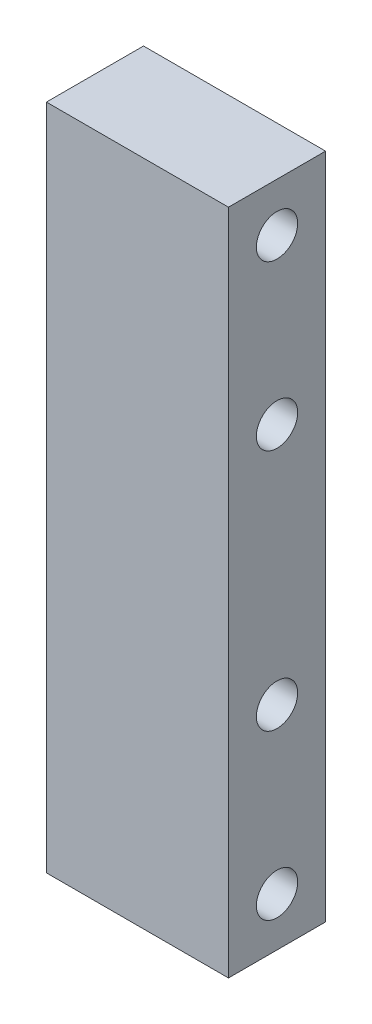
from build123d import *

# Parameters (mm, degrees)
SKETCH1_W            = 8
SKETCH1_H            = 55
BOSS_EXTRUDE1_DEPTH  = 15
M3_CLEARANCE_HOLE1_D = 3.4
SKETCH5_W            = 3.256410257
SKETCH5_H            = 0.284935897
SKETCH5_W_2          = 2.320192308
CUT_EXTRUDE1_DEPTH   = 1


with BuildPart() as part:
    # Sketch1 → Boss-Extrude1 (new body)
    with BuildSketch(Plane(origin=(0, 0, 0), x_dir=(0, 0, -1), z_dir=(1, 0, 0))):
        with Locations((4, 27.5)):
            Rectangle(SKETCH1_W, SKETCH1_H)
    extrude(amount=BOSS_EXTRUDE1_DEPTH)

    # M3 Clearance Hole1 (through all)
    with Locations(Plane(origin=(15, 0, 0), x_dir=(0, 0, -1), z_dir=(1, 0, 0))):
        with Locations((4, 51), (4, 37.5), (4, 17.5), (4, 4)):
            Hole(M3_CLEARANCE_HOLE1_D / 2)

    # Sketch5 → Cut-Extrude1 (cut)
    # profile 1 of 19: a face of its own
    with BuildSketch(Plane(origin=(0, 0, -8), x_dir=(-1, 0, 0), z_dir=(0, 0, -1))):
        Polygon((-5.834115074, 49.181822324), (-5.508474048, 49.181822324), (-5.508474048, 47.512912068), (-5.834115074, 47.512912068), (-5.834115074, 48.204899247), (-8.683474048, 48.204899247), (-8.683474048, 48.489835144), (-5.834115074, 48.489835144), align=None)
    # profile 2 of 19: a face of its own
    with BuildSketch(Plane(origin=(0, 0, -8), x_dir=(-1, 0, 0), z_dir=(0, 0, -1))):
        with BuildLine():
            add(Edge.make_bspline(
                [(-6.322576612, 45.903787468), (-6.323500893, 45.860251447), (-6.325313182, 45.774887949), (-6.344778138, 45.649891814), (-6.3742955, 45.530698932), (-6.415845028, 45.416798004), (-6.470359632, 45.30913122), (-6.536284009, 45.206737291), (-6.614064176, 45.10982137), (-6.674265492, 45.051745759), (-6.704823207, 45.022267036)],
                knots=[0, 0, 0, 0, 1.054042676, 2.066720093, 3.05716247, 4.025731183, 4.997454851, 5.974904663, 6.97207755, 8, 8, 8, 8], degree=3))
            add(Edge.make_bspline(
                [(-6.704823207, 45.022267036), (-6.734045894, 44.996883406), (-6.791925728, 44.946607389), (-6.885774749, 44.88214063), (-6.982966126, 44.826603929), (-7.084790486, 44.782096815), (-7.190358938, 44.747003972), (-7.300034334, 44.722088662), (-7.413574463, 44.707268728), (-7.490685088, 44.705270322), (-7.52973807, 44.704258221)],
                knots=[0, 0, 0, 0, 1.025258237, 2.030674902, 3.01204498, 3.988269485, 4.97094183, 5.956517959, 6.965070386, 8, 8, 8, 8], degree=3))
            add(Edge.make_bspline(
                [(-7.52973807, 44.704258221), (-7.569017408, 44.705148435), (-7.646635212, 44.706907537), (-7.760952779, 44.723547818), (-7.871800943, 44.749429587), (-7.978715603, 44.786469903), (-8.082023642, 44.833966167), (-8.181273559, 44.891924227), (-8.276662237, 44.960750319), (-8.367375587, 45.038769409), (-8.450993219, 45.124990643), (-8.523827278, 45.21854764), (-8.586489548, 45.31766967), (-8.636260814, 45.423709845), (-8.67637992, 45.535158719), (-8.704044626, 45.652725175), (-8.720920847, 45.776304335), (-8.723077789, 45.860695342), (-8.724179176, 45.903787468)],
                knots=[0, 0, 0, 0, 0.998669827, 1.973418153, 2.932281609, 3.89081133, 4.846438734, 5.82045571, 6.809776312, 7.834649874, 8.860672198, 9.859676908, 10.845817165, 11.837296335, 12.833502054, 13.853824644, 14.904110009, 16, 16, 16, 16], degree=3))
            add(Edge.make_bspline(
                [(-8.724179176, 45.903787468), (-8.723068676, 45.947088648), (-8.720893705, 46.031896196), (-8.704170161, 46.155940684), (-8.676084334, 46.274002131), (-8.636757479, 46.385978184), (-8.586080742, 46.49201793), (-8.524071091, 46.591505969), (-8.450956337, 46.685107095), (-8.367385581, 46.771355361), (-8.276659662, 46.849367203), (-8.181274227, 46.918195165), (-8.082023468, 46.976152739), (-7.978715649, 47.02364913), (-7.87180093, 47.060689412), (-7.760952782, 47.086571191), (-7.646635211, 47.103211469), (-7.569017408, 47.104970572), (-7.52973807, 47.105860786)],
                knots=[0, 0, 0, 0, 1.099861214, 2.154133753, 3.1731438, 4.178222029, 5.163564916, 6.153006591, 7.15072618, 8.175428628, 9.198983792, 10.187031731, 11.15979573, 12.114193814, 13.071490482, 14.029120454, 15.002614863, 16, 16, 16, 16], degree=3))
            add(Edge.make_bspline(
                [(-7.52973807, 47.105860786), (-7.490897347, 47.104841783), (-7.413999389, 47.102824332), (-7.300672698, 47.088019299), (-7.191182924, 47.063201179), (-7.086021956, 47.02806627), (-6.984643811, 46.983148918), (-6.887212285, 46.928392607), (-6.793787638, 46.863268247), (-6.735982608, 46.813192191), (-6.706731259, 46.787851971)],
                knots=[0, 0, 0, 0, 1.031353054, 2.041901799, 3.029428768, 4.008703097, 4.981709435, 5.96992636, 6.972712378, 8, 8, 8, 8], degree=3))
            add(Edge.make_bspline(
                [(-6.706731259, 46.787851971), (-6.675913689, 46.758415251), (-6.615305513, 46.700522761), (-6.53767881, 46.603159462), (-6.470865613, 46.501205997), (-6.416378445, 46.392844725), (-6.374370889, 46.278627087), (-6.344640371, 46.15854834), (-6.32539928, 46.033097244), (-6.323526878, 45.947320289), (-6.322576612, 45.903787468)],
                knots=[0, 0, 0, 0, 1.027951202, 2.021646915, 2.998468564, 3.9668038, 4.943370589, 5.93035926, 6.949632805, 8, 8, 8, 8], degree=3))
        make_face()
        with BuildLine():
            add(Edge.make_bspline(
                [(-6.607512509, 45.905059503), (-6.608387579, 45.935845731), (-6.610115129, 45.996623443), (-6.623253417, 46.086085994), (-6.644072606, 46.172208432), (-6.673639836, 46.255165141), (-6.711864684, 46.334635274), (-6.758549655, 46.410706271), (-6.813943396, 46.483173755), (-6.876944905, 46.551481021), (-6.945375591, 46.61490609), (-7.018959485, 46.669710342), (-7.095585608, 46.71639746), (-7.175651706, 46.755249818), (-7.259916044, 46.784196831), (-7.347438397, 46.805217358), (-7.438393281, 46.818344126), (-7.500225086, 46.820055314), (-7.531646123, 46.820924888)],
                knots=[0, 0, 0, 0, 1.021589593, 2.016807015, 2.994807536, 3.958602519, 4.934347097, 5.916793557, 6.916107818, 7.957073844, 8.998039869, 10.008589932, 10.997041759, 11.972786337, 12.956492182, 13.948170289, 14.957322718, 16, 16, 16, 16], degree=3))
            add(Edge.make_bspline(
                [(-7.531646123, 46.820924888), (-7.572244399, 46.819471116), (-7.652824385, 46.81658565), (-7.77146238, 46.793002125), (-7.885572308, 46.753828792), (-7.993780256, 46.69981139), (-8.094071729, 46.633287334), (-8.184254294, 46.555501094), (-8.26085015, 46.465377248), (-8.325268555, 46.365984687), (-8.375997988, 46.258731928), (-8.412377738, 46.145417111), (-8.435708381, 46.027072), (-8.438054667, 45.946086281), (-8.439243279, 45.905059503)],
                knots=[0, 0, 0, 0, 1.016977094, 2.018509362, 3.018404954, 4.033172147, 5.041280572, 6.028085189, 7.007940189, 7.995502847, 8.989109012, 9.972200833, 10.97273166, 12, 12, 12, 12], degree=3))
            add(Edge.make_bspline(
                [(-8.439243279, 45.905059503), (-8.438061553, 45.864030366), (-8.435728858, 45.783039988), (-8.412259537, 45.664530216), (-8.37615618, 45.550904839), (-8.325211259, 45.443540565), (-8.261093635, 45.34410274), (-8.183817935, 45.25462244), (-8.094308802, 45.176166315), (-7.993913236, 45.109576388), (-7.885404086, 45.056429356), (-7.771483406, 45.017071802), (-7.65281903, 44.993544838), (-7.572242605, 44.990651737), (-7.531646123, 44.989194119)],
                knots=[0, 0, 0, 0, 1.027082318, 2.027431966, 3.015401697, 4.008827937, 4.996211763, 5.971861488, 6.96198607, 7.969911943, 8.982141629, 9.981856156, 10.983207064, 12, 12, 12, 12], degree=3))
            add(Edge.make_bspline(
                [(-7.531646123, 44.989194119), (-7.500222577, 44.990057222), (-7.438385835, 44.991755678), (-7.347466861, 45.004975055), (-7.259742936, 45.025669048), (-7.175991286, 45.055883658), (-7.095194561, 45.093402581), (-7.019189581, 45.141225417), (-6.945328813, 45.195774402), (-6.87698615, 45.259315854), (-6.813713203, 45.32761543), (-6.758751442, 45.40062733), (-6.711838025, 45.476733656), (-6.673635128, 45.556228903), (-6.644186411, 45.638997886), (-6.623162725, 45.724858851), (-6.610163032, 45.813925219), (-6.608401668, 45.874487116), (-6.607512509, 45.905059503)],
                knots=[0, 0, 0, 0, 1.043020522, 2.052505155, 3.044509714, 4.030878336, 5.003918577, 5.996372628, 7.007255355, 8.048564058, 9.08987276, 10.095126797, 11.077896669, 12.053962454, 13.01807471, 13.98956039, 14.985105429, 16, 16, 16, 16], degree=3))
        make_face(mode=Mode.SUBTRACT)
    # profile 3 of 19: a face of its own
    with BuildSketch(Plane(origin=(0, 0, -8), x_dir=(-1, 0, 0), z_dir=(0, 0, -1))):
        with BuildLine():
            add(Edge.make_bspline(
                [(-6.322576612, 43.013723366), (-6.323500893, 42.970187345), (-6.325313182, 42.884823847), (-6.344778138, 42.759827711), (-6.3742955, 42.64063483), (-6.415845028, 42.526733902), (-6.470359632, 42.419067117), (-6.536284009, 42.316673189), (-6.614064176, 42.219757268), (-6.674265492, 42.161681656), (-6.704823207, 42.132202933)],
                knots=[0, 0, 0, 0, 1.054042676, 2.066720093, 3.05716247, 4.025731183, 4.997454851, 5.974904663, 6.97207755, 8, 8, 8, 8], degree=3))
            add(Edge.make_bspline(
                [(-6.704823207, 42.132202933), (-6.734045894, 42.106819303), (-6.791925728, 42.056543287), (-6.885774749, 41.992076528), (-6.982966126, 41.936539827), (-7.084790486, 41.892032712), (-7.190358938, 41.856939869), (-7.300034334, 41.832024559), (-7.413574463, 41.817204625), (-7.490685088, 41.815206219), (-7.52973807, 41.814194119)],
                knots=[0, 0, 0, 0, 1.025258237, 2.030674902, 3.01204498, 3.988269485, 4.97094183, 5.956517959, 6.965070386, 8, 8, 8, 8], degree=3))
            add(Edge.make_bspline(
                [(-7.52973807, 41.814194119), (-7.569017408, 41.815084332), (-7.646635212, 41.816843435), (-7.760952779, 41.833483716), (-7.871800943, 41.859365485), (-7.978715603, 41.896405801), (-8.082023642, 41.943902065), (-8.181273559, 42.001860125), (-8.276662237, 42.070686216), (-8.367375587, 42.148705306), (-8.450993219, 42.234926541), (-8.523827278, 42.328483538), (-8.586489548, 42.427605567), (-8.636260814, 42.533645743), (-8.67637992, 42.645094616), (-8.704044626, 42.762661073), (-8.720920847, 42.886240233), (-8.723077789, 42.970631239), (-8.724179176, 43.013723366)],
                knots=[0, 0, 0, 0, 0.998669827, 1.973418153, 2.932281609, 3.89081133, 4.846438734, 5.82045571, 6.809776312, 7.834649874, 8.860672198, 9.859676908, 10.845817165, 11.837296335, 12.833502054, 13.853824644, 14.904110009, 16, 16, 16, 16], degree=3))
            add(Edge.make_bspline(
                [(-8.724179176, 43.013723366), (-8.723068676, 43.057024545), (-8.720893705, 43.141832094), (-8.704170161, 43.265876581), (-8.676084334, 43.383938029), (-8.636757479, 43.495914081), (-8.586080742, 43.601953827), (-8.524071091, 43.701441866), (-8.450956337, 43.795042992), (-8.367385581, 43.881291259), (-8.276659662, 43.959303101), (-8.181274227, 44.028131062), (-8.082023468, 44.086088637), (-7.978715649, 44.133585028), (-7.87180093, 44.17062531), (-7.760952782, 44.196507088), (-7.646635211, 44.213147367), (-7.569017408, 44.21490647), (-7.52973807, 44.215796683)],
                knots=[0, 0, 0, 0, 1.099861214, 2.154133753, 3.1731438, 4.178222029, 5.163564916, 6.153006591, 7.15072618, 8.175428628, 9.198983792, 10.187031731, 11.15979573, 12.114193814, 13.071490482, 14.029120454, 15.002614863, 16, 16, 16, 16], degree=3))
            add(Edge.make_bspline(
                [(-7.52973807, 44.215796683), (-7.490897347, 44.21477768), (-7.413999389, 44.212760229), (-7.300672698, 44.197955196), (-7.191182924, 44.173137077), (-7.086021956, 44.138002167), (-6.984643811, 44.093084816), (-6.887212285, 44.038328504), (-6.793787638, 43.973204145), (-6.735982608, 43.923128089), (-6.706731259, 43.897787869)],
                knots=[0, 0, 0, 0, 1.031353054, 2.041901799, 3.029428768, 4.008703097, 4.981709435, 5.96992636, 6.972712378, 8, 8, 8, 8], degree=3))
            add(Edge.make_bspline(
                [(-6.706731259, 43.897787869), (-6.675913689, 43.868351149), (-6.615305513, 43.810458659), (-6.53767881, 43.71309536), (-6.470865613, 43.611141895), (-6.416378445, 43.502780622), (-6.374370889, 43.388562984), (-6.344640371, 43.268484238), (-6.32539928, 43.143033141), (-6.323526878, 43.057256186), (-6.322576612, 43.013723366)],
                knots=[0, 0, 0, 0, 1.027951202, 2.021646915, 2.998468564, 3.9668038, 4.943370589, 5.93035926, 6.949632805, 8, 8, 8, 8], degree=3))
        make_face()
        with BuildLine():
            add(Edge.make_bspline(
                [(-6.607512509, 43.014995401), (-6.608387579, 43.045781628), (-6.610115129, 43.106559341), (-6.623253417, 43.196021891), (-6.644072606, 43.282144329), (-6.673639836, 43.365101039), (-6.711864684, 43.444571172), (-6.758549655, 43.520642168), (-6.813943396, 43.593109653), (-6.876944905, 43.661416918), (-6.945375591, 43.724841987), (-7.018959485, 43.779646239), (-7.095585608, 43.826333357), (-7.175651706, 43.865185715), (-7.259916044, 43.894132728), (-7.347438397, 43.915153255), (-7.438393281, 43.928280024), (-7.500225086, 43.929991212), (-7.531646123, 43.930860786)],
                knots=[0, 0, 0, 0, 1.021589593, 2.016807015, 2.994807536, 3.958602519, 4.934347097, 5.916793557, 6.916107818, 7.957073844, 8.998039869, 10.008589932, 10.997041759, 11.972786337, 12.956492182, 13.948170289, 14.957322718, 16, 16, 16, 16], degree=3))
            add(Edge.make_bspline(
                [(-7.531646123, 43.930860786), (-7.572244399, 43.929407013), (-7.652824385, 43.926521547), (-7.77146238, 43.902938023), (-7.885572308, 43.86376469), (-7.993780256, 43.809747287), (-8.094071729, 43.743223232), (-8.184254294, 43.665436992), (-8.26085015, 43.575313146), (-8.325268555, 43.475920584), (-8.375997988, 43.368667825), (-8.412377738, 43.255353008), (-8.435708381, 43.137007898), (-8.438054667, 43.056022178), (-8.439243279, 43.014995401)],
                knots=[0, 0, 0, 0, 1.016977094, 2.018509362, 3.018404954, 4.033172147, 5.041280572, 6.028085189, 7.007940189, 7.995502847, 8.989109012, 9.972200833, 10.97273166, 12, 12, 12, 12], degree=3))
            add(Edge.make_bspline(
                [(-8.439243279, 43.014995401), (-8.438061553, 42.973966263), (-8.435728858, 42.892975886), (-8.412259537, 42.774466113), (-8.37615618, 42.660840736), (-8.325211259, 42.553476462), (-8.261093635, 42.454038637), (-8.183817935, 42.364558338), (-8.094308802, 42.286102213), (-7.993913236, 42.219512286), (-7.885404086, 42.166365254), (-7.771483406, 42.1270077), (-7.65281903, 42.103480735), (-7.572242605, 42.100587635), (-7.531646123, 42.099130016)],
                knots=[0, 0, 0, 0, 1.027082318, 2.027431966, 3.015401697, 4.008827937, 4.996211763, 5.971861488, 6.96198607, 7.969911943, 8.982141629, 9.981856156, 10.983207064, 12, 12, 12, 12], degree=3))
            add(Edge.make_bspline(
                [(-7.531646123, 42.099130016), (-7.500222577, 42.09999312), (-7.438385835, 42.101691576), (-7.347466861, 42.114910952), (-7.259742936, 42.135604945), (-7.175991286, 42.165819556), (-7.095194561, 42.203338478), (-7.019189581, 42.251161314), (-6.945328813, 42.3057103), (-6.87698615, 42.369251752), (-6.813713203, 42.437551327), (-6.758751442, 42.510563227), (-6.711838025, 42.586669553), (-6.673635128, 42.666164801), (-6.644186411, 42.748933783), (-6.623162725, 42.834794749), (-6.610163032, 42.923861117), (-6.608401668, 42.984423013), (-6.607512509, 43.014995401)],
                knots=[0, 0, 0, 0, 1.043020522, 2.052505155, 3.044509714, 4.030878336, 5.003918577, 5.996372628, 7.007255355, 8.048564058, 9.08987276, 10.095126797, 11.077896669, 12.053962454, 13.01807471, 13.98956039, 14.985105429, 16, 16, 16, 16], degree=3))
        make_face(mode=Mode.SUBTRACT)
    # profile 4 of 19: a face of its own
    with BuildSketch(Plane(origin=(0, 0, -8), x_dir=(-1, 0, 0), z_dir=(0, 0, -1))):
        with Locations((-7.05526892, 41.142559504)):
            Rectangle(SKETCH5_W, SKETCH5_H)
    # profile 5 of 19: a face of its own
    with BuildSketch(Plane(origin=(0, 0, -8), x_dir=(-1, 0, 0), z_dir=(0, 0, -1))):
        with BuildLine():
            Line((-5.508474048, 39.046245401), (-5.508474048, 38.426764231))
            add(Edge.make_bspline(
                [(-5.508474048, 38.426764231), (-5.508633479, 38.396439826), (-5.508942495, 38.337663581), (-5.51373505, 38.252193088), (-5.520269807, 38.17213881), (-5.530638534, 38.09747753), (-5.543149646, 38.02824375), (-5.55830058, 37.964228822), (-5.576467579, 37.905636309), (-5.605356706, 37.835684041), (-5.64828558, 37.755927441), (-5.711720778, 37.669568899), (-5.789310941, 37.595723625), (-5.876834493, 37.532054609), (-5.9731148, 37.481435022), (-6.075857064, 37.444814302), (-6.183736073, 37.421629658), (-6.257798099, 37.419245293), (-6.295227854, 37.418040273)],
                knots=[0, 0, 0, 0, 1.001505555, 1.941167018, 2.826882275, 3.653841531, 4.429895133, 5.150066043, 5.825578002, 6.45369114, 7.647487171, 8.808567382, 9.977351308, 11.170798116, 12.373658725, 13.556498008, 14.765093433, 16, 16, 16, 16], degree=3))
            add(Edge.make_bspline(
                [(-6.295227854, 37.418040273), (-6.330297185, 37.419012811), (-6.399211727, 37.420923941), (-6.499844503, 37.439821226), (-6.596032989, 37.467956587), (-6.686591379, 37.508800818), (-6.770355803, 37.561339139), (-6.846828451, 37.624562945), (-6.914156073, 37.69983915), (-6.951638965, 37.756328443), (-6.970678575, 37.785022444)],
                knots=[0, 0, 0, 0, 1.044266239, 2.052081639, 3.041743201, 4.026043445, 5.00270663, 5.980942822, 6.97441044, 8, 8, 8, 8], degree=3))
            add(Edge.make_bspline(
                [(-6.970678575, 37.785022444), (-6.984515424, 37.748948016), (-7.010988743, 37.679928698), (-7.05804793, 37.584880705), (-7.108654953, 37.502662082), (-7.164212866, 37.43318233), (-7.224847269, 37.374656391), (-7.28934399, 37.322098883), (-7.360878295, 37.278067475), (-7.437413294, 37.240240784), (-7.518411825, 37.210471575), (-7.603503452, 37.189407906), (-7.691736695, 37.176465307), (-7.751876617, 37.174700454), (-7.782237069, 37.173809503)],
                knots=[0, 0, 0, 0, 1.272302504, 2.434229863, 3.488457646, 4.447234501, 5.35599188, 6.26022912, 7.18267843, 8.11661068, 9.06895546, 10.019249207, 11.000057067, 12, 12, 12, 12], degree=3))
            add(Edge.make_bspline(
                [(-7.782237069, 37.173809503), (-7.813231127, 37.17469592), (-7.874212805, 37.176439971), (-7.96380033, 37.189299259), (-8.049402663, 37.211093547), (-8.13162845, 37.24104009), (-8.210012263, 37.280346167), (-8.285535794, 37.327149461), (-8.356187147, 37.384115002), (-8.423646489, 37.447611161), (-8.484264834, 37.519527391), (-8.538231993, 37.597108117), (-8.582818055, 37.681469205), (-8.619803282, 37.771302436), (-8.648466644, 37.867204757), (-8.66836608, 37.968820584), (-8.681805564, 38.076171999), (-8.68290845, 38.149841375), (-8.683474048, 38.187621603)],
                knots=[0, 0, 0, 0, 0.978404568, 1.925038397, 2.85041836, 3.763147166, 4.682162379, 5.614488577, 6.562659439, 7.54271123, 8.535210642, 9.526693784, 10.520907202, 11.541451354, 12.589717429, 13.675358278, 14.807842563, 16, 16, 16, 16], degree=3))
            Line((-8.683474048, 38.187621603), (-8.683474048, 39.046245401))
            Line((-8.683474048, 39.046245401), (-5.508474048, 39.046245401))
        make_face()
        with BuildLine():
            Line((-5.834115074, 38.761309503), (-6.851743279, 38.761309503))
            Line((-6.851743279, 38.761309503), (-6.851743279, 38.569868197))
            add(Edge.make_bspline(
                [(-6.851743279, 38.569868197), (-6.85138351, 38.541883681), (-6.850688365, 38.487811893), (-6.848634341, 38.409299321), (-6.843134844, 38.336603325), (-6.837318218, 38.269473406), (-6.828361806, 38.208359499), (-6.817401673, 38.153057011), (-6.805911664, 38.103069152), (-6.786316287, 38.045448373), (-6.757650001, 37.980107174), (-6.712116164, 37.910893704), (-6.659355297, 37.848885715), (-6.597353384, 37.797109825), (-6.529661032, 37.754385666), (-6.456272205, 37.725873416), (-6.380051978, 37.705650052), (-6.327588759, 37.703876594), (-6.300952013, 37.70297617)],
                knots=[0, 0, 0, 0, 1.156481963, 2.23455883, 3.244418989, 4.168404366, 5.01828131, 5.794834307, 6.498111525, 7.13526334, 8.307595709, 9.435046769, 10.546766856, 11.659452936, 12.760769924, 13.837671619, 14.902137667, 16, 16, 16, 16], degree=3))
            add(Edge.make_bspline(
                [(-6.300952013, 37.70297617), (-6.283321763, 37.70342651), (-6.248738103, 37.704309901), (-6.198517285, 37.712349809), (-6.150680183, 37.724015793), (-6.106327019, 37.742241619), (-6.064197149, 37.764280411), (-6.026161842, 37.792948878), (-5.990137298, 37.825325299), (-5.957446248, 37.863348254), (-5.92815494, 37.906833633), (-5.902381158, 37.956195773), (-5.882050061, 38.012024083), (-5.863811985, 38.073052718), (-5.851156748, 38.140258388), (-5.840575284, 38.212984403), (-5.835196434, 38.291847718), (-5.834483567, 38.346407759), (-5.834115074, 38.374610786)],
                knots=[0, 0, 0, 0, 0.911752476, 1.788502045, 2.626783689, 3.45400582, 4.26402138, 5.080402872, 5.911472738, 6.767166405, 7.66795952, 8.620018292, 9.640966946, 10.73819047, 11.913090943, 13.176185384, 14.540321519, 16, 16, 16, 16], degree=3))
            Line((-5.834115074, 38.374610786), (-5.834115074, 38.761309503))
        make_face(mode=Mode.SUBTRACT)
        with BuildLine():
            Line((-7.177384304, 38.761309503), (-8.357833022, 38.761309503))
            Line((-8.357833022, 38.761309503), (-8.357833022, 38.355530257))
            add(Edge.make_bspline(
                [(-8.357833022, 38.355530257), (-8.357486124, 38.326484373), (-8.356817524, 38.270502261), (-8.354610996, 38.189676633), (-8.349697384, 38.114965828), (-8.341686887, 38.046326854), (-8.333363283, 37.983155501), (-8.321843011, 37.926079378), (-8.308745856, 37.875010984), (-8.288477387, 37.815803411), (-8.25704371, 37.749089072), (-8.20933974, 37.677244446), (-8.153256159, 37.612730921), (-8.087528268, 37.558575048), (-8.016601507, 37.513855252), (-7.940846846, 37.482490649), (-7.862575334, 37.462323659), (-7.8090704, 37.459940555), (-7.782237069, 37.458745401)],
                knots=[0, 0, 0, 0, 1.159821618, 2.235403267, 3.228114831, 4.14795534, 4.994323282, 5.771256229, 6.471395042, 7.097801288, 8.267864287, 9.404187171, 10.531774336, 11.667624178, 12.792825787, 13.866573821, 14.930062559, 16, 16, 16, 16], degree=3))
            add(Edge.make_bspline(
                [(-7.782237069, 37.458745401), (-7.765458797, 37.458989687), (-7.732172887, 37.459474318), (-7.68329518, 37.467057979), (-7.63573768, 37.47763768), (-7.590219527, 37.492957998), (-7.546000042, 37.512275676), (-7.503849461, 37.53651863), (-7.462759948, 37.564514649), (-7.410873204, 37.608309673), (-7.351070513, 37.671950181), (-7.292527967, 37.762403656), (-7.245312553, 37.865247062), (-7.225265258, 37.939839353), (-7.214909344, 37.978371803)],
                knots=[0, 0, 0, 0, 0.723503378, 1.435336582, 2.130201219, 2.824764462, 3.504949994, 4.209866579, 4.920640069, 5.648298893, 7.13757748, 8.670694625, 10.280166878, 12, 12, 12, 12], degree=3))
            add(Edge.make_bspline(
                [(-7.214909344, 37.978371803), (-7.211774879, 37.993819611), (-7.204978711, 38.027313646), (-7.197809346, 38.0819308), (-7.191378192, 38.144493135), (-7.186745964, 38.214733248), (-7.181773349, 38.292930493), (-7.179908315, 38.379059749), (-7.177631942, 38.473181905), (-7.177468962, 38.538489352), (-7.177384304, 38.572412268)],
                knots=[0, 0, 0, 0, 0.634452549, 1.375623993, 2.216454381, 3.166361212, 4.209414599, 5.370755378, 6.634280627, 8, 8, 8, 8], degree=3))
            Line((-7.177384304, 38.572412268), (-7.177384304, 38.761309503))
        make_face(mode=Mode.SUBTRACT)
    # profile 6 of 19: a face of its own
    with BuildSketch(Plane(origin=(0, 0, -8), x_dir=(-1, 0, 0), z_dir=(0, 0, -1))):
        with BuildLine():
            add(Edge.make_bspline(
                [(-6.322576612, 35.483274648), (-6.323500893, 35.439738627), (-6.325313182, 35.354375129), (-6.344778138, 35.229378993), (-6.3742955, 35.110186112), (-6.415845028, 34.996285184), (-6.470359632, 34.888618399), (-6.536284009, 34.786224471), (-6.614064176, 34.68930855), (-6.674265492, 34.631232938), (-6.704823207, 34.601754215)],
                knots=[0, 0, 0, 0, 1.054042676, 2.066720093, 3.05716247, 4.025731183, 4.997454851, 5.974904663, 6.97207755, 8, 8, 8, 8], degree=3))
            add(Edge.make_bspline(
                [(-6.704823207, 34.601754215), (-6.734045894, 34.576370585), (-6.791925728, 34.526094569), (-6.885774749, 34.46162781), (-6.982966126, 34.406091109), (-7.084790486, 34.361583994), (-7.190358938, 34.326491151), (-7.300034334, 34.301575841), (-7.413574463, 34.286755907), (-7.490685088, 34.284757501), (-7.52973807, 34.283745401)],
                knots=[0, 0, 0, 0, 1.025258237, 2.030674902, 3.01204498, 3.988269485, 4.97094183, 5.956517959, 6.965070386, 8, 8, 8, 8], degree=3))
            add(Edge.make_bspline(
                [(-7.52973807, 34.283745401), (-7.569017408, 34.284635614), (-7.646635212, 34.286394717), (-7.760952779, 34.303034998), (-7.871800943, 34.328916767), (-7.978715603, 34.365957083), (-8.082023642, 34.413453347), (-8.181273559, 34.471411407), (-8.276662237, 34.540237498), (-8.367375587, 34.618256588), (-8.450993219, 34.704477823), (-8.523827278, 34.79803482), (-8.586489548, 34.897156849), (-8.636260814, 35.003197025), (-8.67637992, 35.114645898), (-8.704044626, 35.232212355), (-8.720920847, 35.355791515), (-8.723077789, 35.440182521), (-8.724179176, 35.483274648)],
                knots=[0, 0, 0, 0, 0.998669827, 1.973418153, 2.932281609, 3.89081133, 4.846438734, 5.82045571, 6.809776312, 7.834649874, 8.860672198, 9.859676908, 10.845817165, 11.837296335, 12.833502054, 13.853824644, 14.904110009, 16, 16, 16, 16], degree=3))
            add(Edge.make_bspline(
                [(-8.724179176, 35.483274648), (-8.723068676, 35.526575827), (-8.720893705, 35.611383376), (-8.704170161, 35.735427863), (-8.676084334, 35.853489311), (-8.636757479, 35.965465363), (-8.586080742, 36.071505109), (-8.524071091, 36.170993148), (-8.450956337, 36.264594274), (-8.367385581, 36.350842541), (-8.276659662, 36.428854383), (-8.181274227, 36.497682345), (-8.082023468, 36.555639919), (-7.978715649, 36.60313631), (-7.87180093, 36.640176592), (-7.760952782, 36.66605837), (-7.646635211, 36.682698649), (-7.569017408, 36.684457752), (-7.52973807, 36.685347965)],
                knots=[0, 0, 0, 0, 1.099861214, 2.154133753, 3.1731438, 4.178222029, 5.163564916, 6.153006591, 7.15072618, 8.175428628, 9.198983792, 10.187031731, 11.15979573, 12.114193814, 13.071490482, 14.029120454, 15.002614863, 16, 16, 16, 16], degree=3))
            add(Edge.make_bspline(
                [(-7.52973807, 36.685347965), (-7.490897347, 36.684328962), (-7.413999389, 36.682311511), (-7.300672698, 36.667506478), (-7.191182924, 36.642688359), (-7.086021956, 36.607553449), (-6.984643811, 36.562636098), (-6.887212285, 36.507879786), (-6.793787638, 36.442755427), (-6.735982608, 36.392679371), (-6.706731259, 36.367339151)],
                knots=[0, 0, 0, 0, 1.031353054, 2.041901799, 3.029428768, 4.008703097, 4.981709435, 5.96992636, 6.972712378, 8, 8, 8, 8], degree=3))
            add(Edge.make_bspline(
                [(-6.706731259, 36.367339151), (-6.675913689, 36.337902431), (-6.615305513, 36.280009941), (-6.53767881, 36.182646642), (-6.470865613, 36.080693177), (-6.416378445, 35.972331905), (-6.374370889, 35.858114266), (-6.344640371, 35.73803552), (-6.32539928, 35.612584423), (-6.323526878, 35.526807468), (-6.322576612, 35.483274648)],
                knots=[0, 0, 0, 0, 1.027951202, 2.021646915, 2.998468564, 3.9668038, 4.943370589, 5.93035926, 6.949632805, 8, 8, 8, 8], degree=3))
        make_face()
        with BuildLine():
            add(Edge.make_bspline(
                [(-6.607512509, 35.484546683), (-6.608387579, 35.51533291), (-6.610115129, 35.576110623), (-6.623253417, 35.665573173), (-6.644072606, 35.751695611), (-6.673639836, 35.834652321), (-6.711864684, 35.914122454), (-6.758549655, 35.99019345), (-6.813943396, 36.062660935), (-6.876944905, 36.1309682), (-6.945375591, 36.194393269), (-7.018959485, 36.249197521), (-7.095585608, 36.295884639), (-7.175651706, 36.334736997), (-7.259916044, 36.36368401), (-7.347438397, 36.384704537), (-7.438393281, 36.397831306), (-7.500225086, 36.399542494), (-7.531646123, 36.400412068)],
                knots=[0, 0, 0, 0, 1.021589593, 2.016807015, 2.994807536, 3.958602519, 4.934347097, 5.916793557, 6.916107818, 7.957073844, 8.998039869, 10.008589932, 10.997041759, 11.972786337, 12.956492182, 13.948170289, 14.957322718, 16, 16, 16, 16], degree=3))
            add(Edge.make_bspline(
                [(-7.531646123, 36.400412068), (-7.572244399, 36.398958295), (-7.652824385, 36.396072829), (-7.77146238, 36.372489305), (-7.885572308, 36.333315972), (-7.993780256, 36.27929857), (-8.094071729, 36.212774514), (-8.184254294, 36.134988274), (-8.26085015, 36.044864428), (-8.325268555, 35.945471866), (-8.375997988, 35.838219107), (-8.412377738, 35.72490429), (-8.435708381, 35.60655918), (-8.438054667, 35.52557346), (-8.439243279, 35.484546683)],
                knots=[0, 0, 0, 0, 1.016977094, 2.018509362, 3.018404954, 4.033172147, 5.041280572, 6.028085189, 7.007940189, 7.995502847, 8.989109012, 9.972200833, 10.97273166, 12, 12, 12, 12], degree=3))
            add(Edge.make_bspline(
                [(-8.439243279, 35.484546683), (-8.438061553, 35.443517546), (-8.435728858, 35.362527168), (-8.412259537, 35.244017396), (-8.37615618, 35.130392019), (-8.325211259, 35.023027744), (-8.261093635, 34.923589919), (-8.183817935, 34.83410962), (-8.094308802, 34.755653495), (-7.993913236, 34.689063568), (-7.885404086, 34.635916536), (-7.771483406, 34.596558982), (-7.65281903, 34.573032017), (-7.572242605, 34.570138917), (-7.531646123, 34.568681298)],
                knots=[0, 0, 0, 0, 1.027082318, 2.027431966, 3.015401697, 4.008827937, 4.996211763, 5.971861488, 6.96198607, 7.969911943, 8.982141629, 9.981856156, 10.983207064, 12, 12, 12, 12], degree=3))
            add(Edge.make_bspline(
                [(-7.531646123, 34.568681298), (-7.500222577, 34.569544402), (-7.438385835, 34.571242858), (-7.347466861, 34.584462234), (-7.259742936, 34.605156227), (-7.175991286, 34.635370838), (-7.095194561, 34.67288976), (-7.019189581, 34.720712596), (-6.945328813, 34.775261582), (-6.87698615, 34.838803034), (-6.813713203, 34.907102609), (-6.758751442, 34.980114509), (-6.711838025, 35.056220835), (-6.673635128, 35.135716083), (-6.644186411, 35.218485065), (-6.623162725, 35.304346031), (-6.610163032, 35.393412399), (-6.608401668, 35.453974295), (-6.607512509, 35.484546683)],
                knots=[0, 0, 0, 0, 1.043020522, 2.052505155, 3.044509714, 4.030878336, 5.003918577, 5.996372628, 7.007255355, 8.048564058, 9.08987276, 10.095126797, 11.077896669, 12.053962454, 13.01807471, 13.98956039, 14.985105429, 16, 16, 16, 16], degree=3))
        make_face(mode=Mode.SUBTRACT)
    # profile 7 of 19: a face of its own
    with BuildSketch(Plane(origin=(0, 0, -8), x_dir=(-1, 0, 0), z_dir=(0, 0, -1))):
        with BuildLine():
            Line((-6.36328174, 31.35297617), (-8.683474048, 31.35297617))
            Line((-8.683474048, 31.35297617), (-8.683474048, 31.637912068))
            Line((-8.683474048, 31.637912068), (-8.282146925, 31.637912068))
            add(Edge.make_bspline(
                [(-8.282146925, 31.637912068), (-8.31847836, 31.670035252), (-8.389379612, 31.73272405), (-8.481730169, 31.837408323), (-8.558693216, 31.947912037), (-8.620276259, 32.064608865), (-8.666887418, 32.187149653), (-8.699665735, 32.315184946), (-8.721003525, 32.448544104), (-8.723111129, 32.539490452), (-8.724179176, 32.585578334)],
                knots=[0, 0, 0, 0, 1.074295371, 2.096500925, 3.086030275, 4.053105238, 5.014108356, 5.985331429, 6.979048527, 8, 8, 8, 8], degree=3))
            add(Edge.make_bspline(
                [(-8.724179176, 32.585578334), (-8.723066866, 32.626552232), (-8.720873341, 32.707354573), (-8.703850597, 32.826215063), (-8.67652762, 32.940604658), (-8.638481451, 33.050596262), (-8.588274921, 33.155444589), (-8.527518085, 33.255740434), (-8.455875043, 33.351717868), (-8.373652852, 33.441551602), (-8.284442314, 33.524380531), (-8.189014116, 33.596847478), (-8.088678961, 33.658265575), (-7.983465049, 33.70874025), (-7.873449291, 33.747800201), (-7.758707161, 33.774975358), (-7.639429583, 33.791979758), (-7.558204098, 33.794172172), (-7.517017718, 33.795283862)],
                knots=[0, 0, 0, 0, 1.034036272, 2.039165313, 3.024406509, 3.999331371, 4.971254918, 5.953351348, 6.95522652, 7.989525907, 9.023492927, 10.024309745, 11.009187477, 11.988246066, 12.964946762, 13.950187958, 14.960617622, 16, 16, 16, 16], degree=3))
            add(Edge.make_bspline(
                [(-7.517017718, 33.795283862), (-7.476682615, 33.794147515), (-7.396942292, 33.791901018), (-7.279670529, 33.775157311), (-7.166705506, 33.747022524), (-7.058465687, 33.707463685), (-6.954515155, 33.656962168), (-6.85566722, 33.594487819), (-6.760409788, 33.522046985), (-6.671797595, 33.438332825), (-6.590242483, 33.3476928), (-6.518425334, 33.251178382), (-6.457824274, 33.149993008), (-6.408561503, 33.043933787), (-6.369414307, 32.933751713), (-6.342124941, 32.81860979), (-6.326083163, 32.699031639), (-6.323756693, 32.617851832), (-6.322576612, 32.576674087)],
                knots=[0, 0, 0, 0, 1.02050356, 2.017480486, 2.990790918, 3.96161403, 4.928589988, 5.909588639, 6.91611943, 7.952353252, 8.989586576, 9.99823133, 10.991940466, 11.968822692, 12.952985106, 13.945868367, 14.958059758, 16, 16, 16, 16], degree=3))
            add(Edge.make_bspline(
                [(-6.322576612, 32.576674087), (-6.323874508, 32.529319514), (-6.326419619, 32.436459432), (-6.347825305, 32.300458411), (-6.383544143, 32.17168208), (-6.432634886, 32.049388157), (-6.497385983, 31.934051048), (-6.579804089, 31.827090248), (-6.678006366, 31.726352461), (-6.753655246, 31.667965377), (-6.792593639, 31.637912068)],
                knots=[0, 0, 0, 0, 1.03879612, 2.037030165, 3.012306674, 3.966139504, 4.922386257, 5.905048148, 6.921675258, 8, 8, 8, 8], degree=3))
            Line((-6.792593639, 31.637912068), (-6.36328174, 31.637912068))
            Line((-6.36328174, 31.637912068), (-6.36328174, 31.35297617))
        make_face()
        with BuildLine():
            add(Edge.make_bspline(
                [(-6.607512509, 32.572857981), (-6.608994436, 32.61450887), (-6.611919524, 32.696721099), (-6.634755711, 32.817410653), (-6.672750155, 32.932903469), (-6.724716283, 33.042613712), (-6.790044547, 33.144838883), (-6.8691208, 33.236112147), (-6.959430391, 33.317525494), (-7.061732594, 33.384836645), (-7.170154807, 33.441586642), (-7.284353185, 33.480503051), (-7.401159533, 33.506399292), (-7.480415066, 33.509028314), (-7.520197806, 33.510347965)],
                knots=[0, 0, 0, 0, 1.031093775, 2.03521511, 3.029845951, 4.035119871, 5.034286494, 6.024708811, 7.017619509, 8.03559408, 9.050082311, 10.039808432, 11.016071318, 12, 12, 12, 12], degree=3))
            add(Edge.make_bspline(
                [(-7.520197806, 33.510347965), (-7.559734966, 33.508640646), (-7.638654313, 33.505232699), (-7.755807709, 33.481185657), (-7.869546355, 33.439520286), (-7.979470453, 33.384065613), (-8.081982645, 33.31524462), (-8.174058229, 33.234506951), (-8.253451611, 33.142069786), (-8.319903897, 33.039622881), (-8.373394828, 32.930370972), (-8.411113603, 32.815425411), (-8.434930978, 32.696805829), (-8.43780101, 32.616006101), (-8.439243279, 32.575402052)],
                knots=[0, 0, 0, 0, 0.979154363, 1.954470772, 2.947816011, 3.971783346, 4.997163654, 5.998045606, 6.995988793, 8.00538986, 9.015323546, 10.000094788, 10.994993517, 12, 12, 12, 12], degree=3))
            add(Edge.make_bspline(
                [(-8.439243279, 32.575402052), (-8.437760006, 32.534170683), (-8.434817426, 32.452374142), (-8.41159933, 32.331400527), (-8.374077296, 32.213821266), (-8.321367388, 32.101385388), (-8.256341186, 31.99672065), (-8.179879111, 31.902902024), (-8.091699297, 31.822791511), (-7.994009688, 31.755633681), (-7.887415935, 31.702582362), (-7.773442691, 31.66516458), (-7.652985621, 31.642183071), (-7.570546475, 31.63935542), (-7.528466035, 31.637912068)],
                knots=[0, 0, 0, 0, 1.017484689, 2.018529338, 3.030031036, 4.058138743, 5.076350332, 6.065651025, 7.036469986, 8.00785331, 8.984076697, 9.96571663, 10.961615403, 12, 12, 12, 12], degree=3))
            add(Edge.make_bspline(
                [(-7.528466035, 31.637912068), (-7.496409587, 31.638782627), (-7.433312352, 31.640496163), (-7.340667928, 31.653586554), (-7.252010123, 31.674410671), (-7.1672419, 31.703750649), (-7.086846036, 31.742306053), (-7.010192338, 31.788758394), (-6.937994825, 31.844060479), (-6.870344929, 31.906529324), (-6.808950096, 31.97567813), (-6.754837205, 32.049208923), (-6.709042809, 32.126936701), (-6.672395314, 32.208806904), (-6.642539519, 32.294188959), (-6.622820282, 32.38390124), (-6.609236772, 32.47703961), (-6.608093315, 32.540582235), (-6.607512509, 32.572857981)],
                knots=[0, 0, 0, 0, 1.050062701, 2.066855696, 3.059271411, 4.030305351, 4.999747758, 5.975466543, 6.961907836, 7.974539719, 8.98812422, 9.98710676, 10.961662635, 11.93785114, 12.922015094, 13.919620009, 14.94329489, 16, 16, 16, 16], degree=3))
        make_face(mode=Mode.SUBTRACT)
    # profile 8 of 19: a face of its own
    with BuildSketch(Plane(origin=(0, 0, -8), x_dir=(-1, 0, 0), z_dir=(0, 0, -1))):
        with BuildLine():
            Line((-6.36328174, 30.783104375), (-6.36328174, 30.498168478))
            Line((-6.36328174, 30.498168478), (-6.704823207, 30.498168478))
            add(Edge.make_bspline(
                [(-6.704823207, 30.498168478), (-6.673019235, 30.477135488), (-6.612194387, 30.436910059), (-6.531801833, 30.370009111), (-6.464942138, 30.301503005), (-6.412268162, 30.23053978), (-6.372496916, 30.157712662), (-6.343121005, 30.084232656), (-6.32604552, 30.008577601), (-6.323734464, 29.957635202), (-6.322576612, 29.932112789)],
                knots=[0, 0, 0, 0, 1.280622107, 2.44917983, 3.507334186, 4.490567186, 5.408878616, 6.288712897, 7.142636019, 8, 8, 8, 8], degree=3))
            add(Edge.make_bspline(
                [(-6.322576612, 29.932112789), (-6.323632429, 29.912306777), (-6.325793845, 29.871760908), (-6.341739964, 29.810196646), (-6.366232796, 29.746505046), (-6.389828957, 29.705403584), (-6.402078816, 29.684065914)],
                knots=[0, 0, 0, 0, 0.90119973, 1.844890732, 2.881183062, 4, 4, 4, 4], degree=3))
            Line((-6.402078816, 29.684065914), (-6.648853655, 29.84052625))
            add(Edge.make_bspline(
                [(-6.648853655, 29.84052625), (-6.642739271, 29.854232291), (-6.631132999, 29.88024898), (-6.617397033, 29.918307765), (-6.609309023, 29.953397263), (-6.60808373, 29.975752491), (-6.607512509, 29.986174287)],
                knots=[0, 0, 0, 0, 1.180555205, 2.24091978, 3.179933427, 4, 4, 4, 4], degree=3))
            add(Edge.make_bspline(
                [(-6.607512509, 29.986174287), (-6.608980507, 30.009269255), (-6.61194805, 30.055955539), (-6.636940082, 30.124399694), (-6.675620966, 30.191116303), (-6.720046344, 30.24342666), (-6.762065077, 30.284240089), (-6.798958623, 30.31338105), (-6.840299364, 30.340130329), (-6.885412919, 30.365683516), (-6.935060233, 30.38896687), (-6.988747999, 30.410697073), (-7.046537613, 30.430344785), (-7.086798904, 30.441548217), (-7.107422365, 30.447287068)],
                knots=[0, 0, 0, 0, 1.135927944, 2.296268816, 3.551388088, 4.924624343, 5.663947748, 6.437790805, 7.238014523, 8.089896346, 8.992356783, 9.939655789, 10.944608424, 12, 12, 12, 12], degree=3))
            add(Edge.make_bspline(
                [(-7.107422365, 30.447287068), (-7.125816658, 30.451580024), (-7.16655862, 30.461088598), (-7.234910496, 30.470333778), (-7.315667672, 30.47946827), (-7.409054939, 30.485905916), (-7.514839084, 30.49187314), (-7.633181263, 30.495238715), (-7.764202946, 30.498053707), (-7.855801109, 30.49812906), (-7.903716436, 30.498168478)],
                knots=[0, 0, 0, 0, 0.566838948, 1.255505196, 2.06880316, 3.007127437, 4.065329342, 5.249902469, 6.561414163, 8, 8, 8, 8], degree=3))
            Line((-7.903716436, 30.498168478), (-8.683474048, 30.498168478))
            Line((-8.683474048, 30.498168478), (-8.683474048, 30.783104375))
            Line((-8.683474048, 30.783104375), (-6.36328174, 30.783104375))
        make_face()
    # profile 9 of 19: a face of its own
    with BuildSketch(Plane(origin=(0, 0, -8), x_dir=(-1, 0, 0), z_dir=(0, 0, -1))):
        with BuildLine():
            Line((-5.427063791, 26.997527452), (-8.683474048, 26.997527452))
            Line((-8.683474048, 26.997527452), (-8.683474048, 27.28246335))
            Line((-8.683474048, 27.28246335), (-8.282146925, 27.28246335))
            add(Edge.make_bspline(
                [(-8.282146925, 27.28246335), (-8.31847836, 27.314586534), (-8.389379612, 27.377275332), (-8.481730169, 27.481959605), (-8.558693216, 27.592463319), (-8.620276259, 27.709160147), (-8.666887418, 27.831700935), (-8.699665735, 27.959736228), (-8.721003525, 28.093095386), (-8.723111129, 28.184041734), (-8.724179176, 28.230129616)],
                knots=[0, 0, 0, 0, 1.074295371, 2.096500925, 3.086030275, 4.053105238, 5.014108356, 5.985331429, 6.979048527, 8, 8, 8, 8], degree=3))
            add(Edge.make_bspline(
                [(-8.724179176, 28.230129616), (-8.723066866, 28.271103514), (-8.720873341, 28.351905855), (-8.703850597, 28.470766345), (-8.67652762, 28.58515594), (-8.638481451, 28.695147544), (-8.588274921, 28.799995871), (-8.527518085, 28.900291716), (-8.455875043, 28.99626915), (-8.373652852, 29.086102884), (-8.284442314, 29.168931813), (-8.189014116, 29.24139876), (-8.088678961, 29.302816857), (-7.983465049, 29.353291532), (-7.873449291, 29.392351483), (-7.758707161, 29.41952664), (-7.639429583, 29.43653104), (-7.558204098, 29.438723454), (-7.517017718, 29.439835144)],
                knots=[0, 0, 0, 0, 1.034036272, 2.039165313, 3.024406509, 3.999331371, 4.971254918, 5.953351348, 6.95522652, 7.989525907, 9.023492927, 10.024309745, 11.009187477, 11.988246066, 12.964946762, 13.950187958, 14.960617622, 16, 16, 16, 16], degree=3))
            add(Edge.make_bspline(
                [(-7.517017718, 29.439835144), (-7.476682615, 29.438698797), (-7.396942292, 29.4364523), (-7.279670529, 29.419708593), (-7.166705506, 29.391573806), (-7.058465687, 29.352014967), (-6.954515155, 29.30151345), (-6.85566722, 29.239039101), (-6.760409788, 29.166598268), (-6.671797595, 29.082884107), (-6.590242483, 28.992244082), (-6.518425334, 28.895729664), (-6.457824274, 28.79454429), (-6.408561503, 28.688485069), (-6.369414307, 28.578302995), (-6.342124941, 28.463161072), (-6.326083163, 28.343582921), (-6.323756693, 28.262403114), (-6.322576612, 28.221225369)],
                knots=[0, 0, 0, 0, 1.02050356, 2.017480486, 2.990790918, 3.96161403, 4.928589988, 5.909588639, 6.91611943, 7.952353252, 8.989586576, 9.99823133, 10.991940466, 11.968822692, 12.952985106, 13.945868367, 14.958059758, 16, 16, 16, 16], degree=3))
            add(Edge.make_bspline(
                [(-6.322576612, 28.221225369), (-6.323991459, 28.173855152), (-6.326768645, 28.080872681), (-6.350218129, 27.944722623), (-6.389116736, 27.815805101), (-6.442912249, 27.693665614), (-6.512330839, 27.579030179), (-6.596906897, 27.471428014), (-6.69763461, 27.371664283), (-6.773502201, 27.312650322), (-6.812310186, 27.28246335)],
                knots=[0, 0, 0, 0, 1.030970925, 2.023681352, 2.997808474, 3.956843046, 4.921958419, 5.908293655, 6.930045022, 8, 8, 8, 8], degree=3))
            Line((-6.812310186, 27.28246335), (-5.427063791, 27.28246335))
            Line((-5.427063791, 27.28246335), (-5.427063791, 26.997527452))
        make_face()
        with BuildLine():
            add(Edge.make_bspline(
                [(-6.607512509, 28.217409263), (-6.608994436, 28.259060152), (-6.611919524, 28.341272381), (-6.634755711, 28.461961935), (-6.672750155, 28.577454751), (-6.724716283, 28.687164994), (-6.790044547, 28.789390165), (-6.8691208, 28.880663429), (-6.959430391, 28.962076776), (-7.061732594, 29.029387927), (-7.170154807, 29.086137925), (-7.284353185, 29.125054333), (-7.401159533, 29.150950574), (-7.480415066, 29.153579596), (-7.520197806, 29.154899247)],
                knots=[0, 0, 0, 0, 1.031093775, 2.03521511, 3.029845951, 4.035119871, 5.034286494, 6.024708811, 7.017619509, 8.03559408, 9.050082311, 10.039808432, 11.016071318, 12, 12, 12, 12], degree=3))
            add(Edge.make_bspline(
                [(-7.520197806, 29.154899247), (-7.559734966, 29.153191928), (-7.638654313, 29.149783981), (-7.755807709, 29.125736939), (-7.869546355, 29.084071568), (-7.979470453, 29.028616895), (-8.081982645, 28.959795903), (-8.174058229, 28.879058233), (-8.253451611, 28.786621068), (-8.319903897, 28.684174163), (-8.373394828, 28.574922254), (-8.411113603, 28.459976693), (-8.434930978, 28.341357111), (-8.43780101, 28.260557383), (-8.439243279, 28.219953334)],
                knots=[0, 0, 0, 0, 0.979154363, 1.954470772, 2.947816011, 3.971783346, 4.997163654, 5.998045606, 6.995988793, 8.00538986, 9.015323546, 10.000094788, 10.994993517, 12, 12, 12, 12], degree=3))
            add(Edge.make_bspline(
                [(-8.439243279, 28.219953334), (-8.437760006, 28.178721965), (-8.434817426, 28.096925424), (-8.41159933, 27.975951809), (-8.374077296, 27.858372548), (-8.321367388, 27.74593667), (-8.256341186, 27.641271932), (-8.179879111, 27.547453306), (-8.091699297, 27.467342793), (-7.994009688, 27.400184963), (-7.887415935, 27.347133644), (-7.773442691, 27.309715862), (-7.652985621, 27.286734353), (-7.570546475, 27.283906702), (-7.528466035, 27.28246335)],
                knots=[0, 0, 0, 0, 1.017484689, 2.018529338, 3.030031036, 4.058138743, 5.076350332, 6.065651025, 7.036469986, 8.00785331, 8.984076697, 9.96571663, 10.961615403, 12, 12, 12, 12], degree=3))
            add(Edge.make_bspline(
                [(-7.528466035, 27.28246335), (-7.496409587, 27.283333909), (-7.433312352, 27.285047445), (-7.340667928, 27.298137836), (-7.252010123, 27.318961953), (-7.1672419, 27.348301931), (-7.086846036, 27.386857335), (-7.010192338, 27.433309676), (-6.937994825, 27.488611761), (-6.870344929, 27.551080606), (-6.808950096, 27.620229412), (-6.754837205, 27.693760205), (-6.709042809, 27.771487984), (-6.672395314, 27.853358186), (-6.642539519, 27.938740242), (-6.622820282, 28.028452522), (-6.609236772, 28.121590892), (-6.608093315, 28.185133517), (-6.607512509, 28.217409263)],
                knots=[0, 0, 0, 0, 1.050062701, 2.066855696, 3.059271411, 4.030305351, 4.999747758, 5.975466543, 6.961907836, 7.974539719, 8.98812422, 9.98710676, 10.961662635, 11.93785114, 12.922015094, 13.919620009, 14.94329489, 16, 16, 16, 16], degree=3))
        make_face(mode=Mode.SUBTRACT)
    # profile 10 of 19: a face of its own
    with BuildSketch(Plane(origin=(0, 0, -8), x_dir=(-1, 0, 0), z_dir=(0, 0, -1))):
        Polygon((-5.508474048, 25.043681298), (-5.508474048, 23.252655657), (-5.834115074, 23.252655657), (-5.834115074, 24.758745401), (-6.81103815, 24.758745401), (-6.81103815, 23.252655657), (-7.136679176, 23.252655657), (-7.136679176, 24.758745401), (-8.357833022, 24.758745401), (-8.357833022, 23.252655657), (-8.683474048, 23.252655657), (-8.683474048, 25.043681298), align=None)
    # profile 11 of 19: a face of its own
    with BuildSketch(Plane(origin=(0, 0, -8), x_dir=(-1, 0, 0), z_dir=(0, 0, -1))):
        Polygon((-6.36328174, 22.96771976), (-6.36328174, 22.628722364), (-7.200280939, 22.031501811), (-6.36328174, 21.434281258), (-6.36328174, 21.095283862), (-7.437515514, 21.861685104), (-8.683474048, 20.973168478), (-8.683474048, 21.312165874), (-7.675386107, 22.031501811), (-8.683474048, 22.750837749), (-8.683474048, 23.089835144), (-7.437515514, 22.2006825), align=None)
    # profile 12 of 19: a face of its own
    with BuildSketch(Plane(origin=(0, 0, -8), x_dir=(-1, 0, 0), z_dir=(0, 0, -1))):
        Polygon((-5.427063791, 20.362591555), (-5.427063791, 20.077655657), (-6.36328174, 20.077655657), (-6.36328174, 19.670604375), (-6.648217638, 19.670604375), (-6.648217638, 20.077655657), (-8.683474048, 20.077655657), (-8.683474048, 20.362591555), (-6.648217638, 20.362591555), (-6.648217638, 20.769642837), (-6.36328174, 20.769642837), (-6.36328174, 20.362591555), align=None)
    # profile 13 of 19: a face of its own
    with BuildSketch(Plane(origin=(0, 0, -8), x_dir=(-1, 0, 0), z_dir=(0, 0, -1))):
        with BuildLine():
            Line((-7.95078174, 17.23720093), (-8.083709425, 16.984065914))
            add(Edge.make_bspline(
                [(-8.083709425, 16.984065914), (-8.119487234, 17.004240584), (-8.189096683, 17.043492503), (-8.284778752, 17.110944643), (-8.370559188, 17.18173894), (-8.445110063, 17.258317056), (-8.509746509, 17.33973582), (-8.565925633, 17.426114836), (-8.614326506, 17.517165463), (-8.654887797, 17.613208662), (-8.686111971, 17.715074216), (-8.708156597, 17.823045476), (-8.721785626, 17.93731913), (-8.723368609, 18.015647519), (-8.724179176, 18.055755617)],
                knots=[0, 0, 0, 0, 1.120373846, 2.179803828, 3.190307243, 4.151866639, 5.090753574, 6.023181945, 6.960194942, 7.901556876, 8.864247182, 9.862852693, 10.905672442, 12, 12, 12, 12], degree=3))
            add(Edge.make_bspline(
                [(-8.724179176, 18.055755617), (-8.723138524, 18.100334411), (-8.721108514, 18.187294723), (-8.703607493, 18.313877211), (-8.675057564, 18.433057102), (-8.635174551, 18.544827754), (-8.583079713, 18.648915241), (-8.51961666, 18.745527204), (-8.445110248, 18.835168837), (-8.358919506, 18.915026182), (-8.266669258, 18.986886428), (-8.170588954, 19.050410497), (-8.070629734, 19.103147602), (-7.96834615, 19.147497034), (-7.862796898, 19.181098998), (-7.754560461, 19.205695697), (-7.643100515, 19.219604094), (-7.567723504, 19.22176101), (-7.52973807, 19.222847965)],
                knots=[0, 0, 0, 0, 1.145226127, 2.234004399, 3.276654467, 4.290038057, 5.276870678, 6.260645262, 7.254731018, 8.264593254, 9.273837991, 10.257612574, 11.220387342, 12.174754112, 13.118989047, 14.062768009, 15.023752772, 16, 16, 16, 16], degree=3))
            add(Edge.make_bspline(
                [(-7.52973807, 19.222847965), (-7.494092046, 19.221887172), (-7.423446332, 19.219983009), (-7.318884017, 19.207980794), (-7.217258206, 19.186709843), (-7.118484457, 19.15752132), (-7.02272815, 19.119828404), (-6.929931006, 19.07371632), (-6.840191772, 19.019113234), (-6.783583215, 18.97695588), (-6.755068599, 18.955720561)],
                knots=[0, 0, 0, 0, 1.024358464, 2.0301432, 3.019427413, 4.004406732, 4.986367066, 5.972626655, 6.978780325, 8, 8, 8, 8], degree=3))
            add(Edge.make_bspline(
                [(-6.755068599, 18.955720561), (-6.720716124, 18.926957163), (-6.653099373, 18.870341519), (-6.564255321, 18.774586825), (-6.489829896, 18.670900218), (-6.428137708, 18.5605811), (-6.381262329, 18.442347299), (-6.34633045, 18.317788156), (-6.326756112, 18.185485375), (-6.323991291, 18.095038496), (-6.322576612, 18.048759423)],
                knots=[0, 0, 0, 0, 1.030682036, 2.02871468, 2.997146059, 3.962720338, 4.930598197, 5.918074684, 6.934738563, 8, 8, 8, 8], degree=3))
            add(Edge.make_bspline(
                [(-6.322576612, 18.048759423), (-6.323804928, 18.001181953), (-6.326214603, 17.907845801), (-6.348554206, 17.771745234), (-6.383980452, 17.642966584), (-6.434012819, 17.521561384), (-6.498564698, 17.407517324), (-6.57852194, 17.301575694), (-6.671429776, 17.201924679), (-6.742879259, 17.143950468), (-6.779237269, 17.114449527)],
                knots=[0, 0, 0, 0, 1.056321875, 2.072262726, 3.055038591, 4.01806755, 4.982017516, 5.957941055, 6.960871419, 8, 8, 8, 8], degree=3))
            add(Edge.make_bspline(
                [(-6.779237269, 17.114449527), (-6.806636232, 17.094377233), (-6.861251783, 17.054366253), (-6.950307047, 17.00424924), (-7.043480229, 16.960745032), (-7.142277427, 16.92597156), (-7.245528046, 16.897814299), (-7.353970211, 16.877442756), (-7.467571631, 16.86549603), (-7.544975006, 16.863147712), (-7.584435586, 16.861950529)],
                knots=[0, 0, 0, 0, 0.94817472, 1.890038105, 2.849395472, 3.817997239, 4.812318967, 5.836947057, 6.897266129, 8, 8, 8, 8], degree=3))
            Line((-7.584435586, 16.861950529), (-7.584435586, 18.937912068))
            add(Edge.make_bspline(
                [(-7.584435586, 18.937912068), (-7.615006103, 18.936514098), (-7.675121792, 18.933765048), (-7.763096934, 18.920979448), (-7.846860905, 18.90072832), (-7.926056805, 18.872578665), (-8.000944664, 18.837281901), (-8.072040597, 18.795403294), (-8.13826488, 18.745135687), (-8.200475695, 18.689160806), (-8.255856261, 18.626825121), (-8.305462862, 18.561268985), (-8.346810105, 18.49163196), (-8.380877053, 18.418616048), (-8.407097258, 18.341842583), (-8.425153382, 18.261419529), (-8.437215782, 18.177597066), (-8.438559299, 18.120460583), (-8.439243279, 18.091372604)],
                knots=[0, 0, 0, 0, 1.094405546, 2.152104367, 3.174987145, 4.173015398, 5.153654967, 6.133208507, 7.119289451, 8.123438607, 9.122504012, 10.097966803, 11.060604936, 12.014205423, 12.976096155, 13.956823727, 14.959826266, 16, 16, 16, 16], degree=3))
            add(Edge.make_bspline(
                [(-8.439243279, 18.091372604), (-8.438695521, 18.06293191), (-8.437608663, 18.006500118), (-8.426883367, 17.922265985), (-8.409824908, 17.839349384), (-8.386378794, 17.75834586), (-8.357496063, 17.681016639), (-8.322874952, 17.609197039), (-8.285015324, 17.542645109), (-8.241033379, 17.480802675), (-8.187756344, 17.420817862), (-8.120509749, 17.362062351), (-8.041794313, 17.298210851), (-7.982308596, 17.258334834), (-7.95078174, 17.23720093)],
                knots=[0, 0, 0, 0, 0.990963276, 1.966261236, 2.95471375, 3.93937425, 4.902926125, 5.828461241, 6.715766441, 7.568835615, 8.469155523, 9.505141836, 10.677749234, 12, 12, 12, 12], degree=3))
        make_face()
        with BuildLine():
            add(Edge.make_bspline(
                [(-7.299499689, 17.146886427), (-7.261696377, 17.157297722), (-7.18893717, 17.177336114), (-7.088420965, 17.219476307), (-6.998570259, 17.26585584), (-6.920868618, 17.321836469), (-6.852339761, 17.385811431), (-6.791847087, 17.458925746), (-6.737988998, 17.541007324), (-6.692481562, 17.6314908), (-6.653759067, 17.727326396), (-6.627791113, 17.827661101), (-6.610002689, 17.930039477), (-6.608346117, 17.999285547), (-6.607512509, 18.034131018)],
                knots=[0, 0, 0, 0, 1.154756201, 2.222533969, 3.206705588, 4.129403772, 5.035894089, 5.963342549, 6.920206228, 7.923656548, 8.944970878, 9.96070521, 10.973801891, 12, 12, 12, 12], degree=3))
            add(Edge.make_bspline(
                [(-6.607512509, 18.034131018), (-6.608069725, 18.06256865), (-6.609171223, 18.118783869), (-6.619542431, 18.201618357), (-6.636908847, 18.281312716), (-6.6600364, 18.358305751), (-6.691901481, 18.431257312), (-6.728506832, 18.502065854), (-6.773480082, 18.568982323), (-6.807728407, 18.610840824), (-6.825030538, 18.631987588)],
                knots=[0, 0, 0, 0, 1.048700258, 2.073059931, 3.073189922, 4.055269162, 5.032885305, 6.005420607, 6.992345662, 8, 8, 8, 8], degree=3))
            add(Edge.make_bspline(
                [(-6.825030538, 18.631987588), (-6.838723239, 18.64713078), (-6.866433928, 18.677776909), (-6.914176137, 18.71872581), (-6.965657911, 18.757932954), (-7.022848845, 18.793614196), (-7.085097695, 18.826341721), (-7.151879407, 18.856966843), (-7.223700746, 18.884531659), (-7.27375003, 18.900040273), (-7.299499689, 18.908019239)],
                knots=[0, 0, 0, 0, 0.879870761, 1.780643979, 2.707998968, 3.669668524, 4.684282772, 5.740141944, 6.837334558, 8, 8, 8, 8], degree=3))
            Line((-7.299499689, 18.908019239), (-7.299499689, 17.146886427))
        make_face(mode=Mode.SUBTRACT)
    # profile 14 of 19: a face of its own
    with BuildSketch(Plane(origin=(0, 0, -8), x_dir=(-1, 0, 0), z_dir=(0, 0, -1))):
        with BuildLine():
            Line((-6.36328174, 16.292078734), (-6.36328174, 16.007142837))
            Line((-6.36328174, 16.007142837), (-6.78178134, 16.007142837))
            add(Edge.make_bspline(
                [(-6.78178134, 16.007142837), (-6.743824012, 15.976719411), (-6.670166495, 15.917681691), (-6.573355688, 15.819361617), (-6.493576805, 15.715453936), (-6.429982649, 15.606594976), (-6.38204321, 15.492636959), (-6.347421258, 15.374274529), (-6.326661449, 15.250799045), (-6.323948883, 15.166829878), (-6.322576612, 15.124350369)],
                knots=[0, 0, 0, 0, 1.12780773, 2.188550248, 3.19190651, 4.159438251, 5.104880172, 6.052711206, 7.014878035, 8, 8, 8, 8], degree=3))
            add(Edge.make_bspline(
                [(-6.322576612, 15.124350369), (-6.324162109, 15.081415882), (-6.327265309, 14.997382736), (-6.351740107, 14.875012713), (-6.393787199, 14.760621407), (-6.450802104, 14.654459408), (-6.522085595, 14.558966293), (-6.605576895, 14.475861359), (-6.700875997, 14.406539415), (-6.789558151, 14.360130274), (-6.868192491, 14.329531385), (-6.93554602, 14.310271772), (-7.010582858, 14.293914745), (-7.093078161, 14.279734624), (-7.183609345, 14.27013964), (-7.281805475, 14.262571999), (-7.387634691, 14.257148466), (-7.460828989, 14.256933286), (-7.498573207, 14.256822324)],
                knots=[0, 0, 0, 0, 1.235764744, 2.418689688, 3.575570385, 4.733739044, 5.876600945, 6.994686206, 8.113221397, 9.257403329, 9.866223892, 10.540462211, 11.272173464, 12.077110251, 12.949508505, 13.892531187, 14.913238277, 16, 16, 16, 16], degree=3))
            Line((-7.498573207, 14.256822324), (-8.683474048, 14.256822324))
            Line((-8.683474048, 14.256822324), (-8.683474048, 14.541758221))
            Line((-8.683474048, 14.541758221), (-7.592067798, 14.541758221))
            add(Edge.make_bspline(
                [(-7.592067798, 14.541758221), (-7.560478866, 14.541933489), (-7.500054615, 14.542268745), (-7.413541286, 14.543326153), (-7.335085605, 14.545875049), (-7.264875135, 14.549456733), (-7.202977298, 14.554699139), (-7.149266026, 14.560162526), (-7.103809512, 14.566843612), (-7.076445473, 14.572797112), (-7.064173166, 14.575467156)],
                knots=[0, 0, 0, 0, 1.430800155, 2.736877192, 3.918605307, 4.986035426, 5.920637409, 6.731861385, 7.431261377, 8, 8, 8, 8], degree=3))
            add(Edge.make_bspline(
                [(-7.064173166, 14.575467156), (-7.028149449, 14.585106031), (-6.958814938, 14.603657883), (-6.864767489, 14.649499425), (-6.784759133, 14.707388003), (-6.719284536, 14.778052481), (-6.668329562, 14.860810285), (-6.632974618, 14.955431764), (-6.610861859, 15.061003817), (-6.608660104, 15.135257436), (-6.607512509, 15.173959744)],
                knots=[0, 0, 0, 0, 1.084156227, 2.086665306, 3.027808233, 3.945421172, 4.874247719, 5.839848303, 6.874090471, 8, 8, 8, 8], degree=3))
            add(Edge.make_bspline(
                [(-6.607512509, 15.173959744), (-6.607944153, 15.196881223), (-6.608798364, 15.242242237), (-6.617374386, 15.309505684), (-6.631388635, 15.374755567), (-6.650351837, 15.438620599), (-6.676156758, 15.499746035), (-6.706026305, 15.55991812), (-6.742602613, 15.617414839), (-6.783586866, 15.673323655), (-6.829262738, 15.725276929), (-6.876753671, 15.774310682), (-6.928059046, 15.817392129), (-6.981362095, 15.856498249), (-7.037734299, 15.890214553), (-7.096572879, 15.919656737), (-7.157970956, 15.944634851), (-7.200583953, 15.957047101), (-7.221905538, 15.96325762)],
                knots=[0, 0, 0, 0, 1.02388931, 2.02625049, 3.024079426, 4.004119353, 4.998163158, 5.985366248, 7.002659681, 8.039138713, 9.080111048, 10.09169763, 11.086418407, 12.069932368, 13.043171485, 14.017654831, 15.008125612, 16, 16, 16, 16], degree=3))
            add(Edge.make_bspline(
                [(-7.221905538, 15.96325762), (-7.237558472, 15.966831445), (-7.271634091, 15.974611473), (-7.327554386, 15.9830145), (-7.392242721, 15.990641372), (-7.465623608, 15.997024899), (-7.547953966, 16.000930527), (-7.638882191, 16.005189015), (-7.738770855, 16.006739378), (-7.808313962, 16.007004584), (-7.844566796, 16.007142837)],
                knots=[0, 0, 0, 0, 0.615963638, 1.340920617, 2.168419149, 3.115676021, 4.16674242, 5.331190069, 6.6087489, 8, 8, 8, 8], degree=3))
            Line((-7.844566796, 16.007142837), (-8.683474048, 16.007142837))
            Line((-8.683474048, 16.007142837), (-8.683474048, 16.292078734))
            Line((-8.683474048, 16.292078734), (-6.36328174, 16.292078734))
        make_face()
    # profile 15 of 19: a face of its own
    with BuildSketch(Plane(origin=(0, 0, -8), x_dir=(-1, 0, 0), z_dir=(0, 0, -1))):
        with BuildLine():
            Line((-6.652669761, 12.506501811), (-6.851743279, 12.69985117))
            add(Edge.make_bspline(
                [(-6.851743279, 12.69985117), (-6.83240503, 12.716531247), (-6.795123164, 12.748688472), (-6.745343167, 12.799734976), (-6.703190023, 12.850567416), (-6.668505199, 12.900917687), (-6.641207923, 12.95087975), (-6.621928144, 13.000880187), (-6.609824368, 13.05078179), (-6.608273874, 13.084154657), (-6.607512509, 13.100542276)],
                knots=[0, 0, 0, 0, 1.265880991, 2.440469525, 3.530740057, 4.536711111, 5.468008477, 6.34654737, 7.188078389, 8, 8, 8, 8], degree=3))
            add(Edge.make_bspline(
                [(-6.607512509, 13.100542276), (-6.608497084, 13.120620255), (-6.610434587, 13.160130875), (-6.629390521, 13.216664794), (-6.659186068, 13.268780017), (-6.700603574, 13.314278545), (-6.748713432, 13.352612617), (-6.801851365, 13.381667691), (-6.859622231, 13.398681757), (-6.899547491, 13.400893075), (-6.919797165, 13.402014632)],
                knots=[0, 0, 0, 0, 1.000196853, 1.968245854, 2.94569445, 3.981000421, 5.021494845, 6.007172807, 6.989258906, 8, 8, 8, 8], degree=3))
            add(Edge.make_bspline(
                [(-6.919797165, 13.402014632), (-6.938132376, 13.401006966), (-6.974751113, 13.398994476), (-7.028769686, 13.383349274), (-7.081435714, 13.358433623), (-7.11369635, 13.33514709), (-7.130319, 13.323148446)],
                knots=[0, 0, 0, 0, 0.960159726, 1.917612774, 2.927026955, 4, 4, 4, 4], degree=3))
            add(Edge.make_bspline(
                [(-7.130319, 13.323148446), (-7.139195016, 13.315924419), (-7.158086497, 13.300548989), (-7.184306421, 13.271694122), (-7.213282606, 13.239016566), (-7.242253879, 13.199719194), (-7.272762658, 13.155495047), (-7.30360745, 13.105385125), (-7.337139464, 13.050979681), (-7.358406917, 13.01202941), (-7.369461628, 12.991783261)],
                knots=[0, 0, 0, 0, 0.66740084, 1.420478572, 2.27185888, 3.217733974, 4.268547843, 5.408967954, 6.65319498, 8, 8, 8, 8], degree=3))
            add(Edge.make_bspline(
                [(-7.369461628, 12.991783261), (-7.383290933, 12.967096659), (-7.410004596, 12.919410273), (-7.451469827, 12.851653263), (-7.492682619, 12.790160733), (-7.533202217, 12.734411663), (-7.574162319, 12.685478736), (-7.613992927, 12.641877321), (-7.653897513, 12.604694946), (-7.681776838, 12.583872456), (-7.695102654, 12.57391968)],
                knots=[0, 0, 0, 0, 1.27191281, 2.456916733, 3.569705269, 4.599008579, 5.553216877, 6.436649441, 7.252746552, 8, 8, 8, 8], degree=3))
            add(Edge.make_bspline(
                [(-7.695102654, 12.57391968), (-7.721984747, 12.557317328), (-7.775419349, 12.524316176), (-7.864004764, 12.491012669), (-7.957188522, 12.469726252), (-8.021260166, 12.467120654), (-8.053816596, 12.465796683)],
                knots=[0, 0, 0, 0, 0.995606783, 1.979007074, 2.973082153, 4, 4, 4, 4], degree=3))
            add(Edge.make_bspline(
                [(-8.053816596, 12.465796683), (-8.076740063, 12.466447905), (-8.121913259, 12.46773121), (-8.188427783, 12.47669538), (-8.252088972, 12.491996944), (-8.313269337, 12.51320572), (-8.371849631, 12.540402741), (-8.427388571, 12.574584985), (-8.480357863, 12.61421769), (-8.530459759, 12.659068519), (-8.575915833, 12.708882343), (-8.615462042, 12.76244744), (-8.648861264, 12.818957128), (-8.676280259, 12.878425191), (-8.698123413, 12.940978023), (-8.713236014, 13.006667346), (-8.722283467, 13.075272903), (-8.723539283, 13.121927159), (-8.724179176, 13.145699527)],
                knots=[0, 0, 0, 0, 1.032633728, 2.034917567, 3.017159222, 3.977707287, 4.947659047, 5.920662675, 6.910168127, 7.92466491, 8.94557085, 9.942744688, 10.919024275, 11.897637117, 12.88838639, 13.898512555, 14.929200919, 16, 16, 16, 16], degree=3))
            add(Edge.make_bspline(
                [(-8.724179176, 13.145699527), (-8.723278655, 13.177782608), (-8.721490126, 13.241502978), (-8.704702485, 13.335745794), (-8.678580949, 13.427839625), (-8.642552923, 13.517087551), (-8.597059062, 13.601493669), (-8.54257389, 13.678719579), (-8.48089725, 13.749033548), (-8.433623395, 13.789055125), (-8.409986468, 13.809065914)],
                knots=[0, 0, 0, 0, 1.013940152, 2.01379169, 3.017749504, 4.037548394, 5.051665909, 6.043208538, 7.021604269, 8, 8, 8, 8], degree=3))
            Line((-8.409986468, 13.809065914), (-8.195012509, 13.620168678))
            add(Edge.make_bspline(
                [(-8.195012509, 13.620168678), (-8.214384332, 13.602232275), (-8.251939538, 13.567459845), (-8.30194519, 13.511850884), (-8.343856343, 13.455263856), (-8.37891144, 13.398263819), (-8.405921985, 13.340007019), (-8.424898138, 13.280819926), (-8.437093941, 13.220822927), (-8.438525668, 13.180525704), (-8.439243279, 13.160327933)],
                knots=[0, 0, 0, 0, 1.179806542, 2.287233372, 3.337373186, 4.324005949, 5.273901747, 6.200048787, 7.097828587, 8, 8, 8, 8], degree=3))
            add(Edge.make_bspline(
                [(-8.439243279, 13.160327933), (-8.437999745, 13.132825243), (-8.435570088, 13.0790896), (-8.413511012, 13.002124191), (-8.378921698, 12.931059865), (-8.32985915, 12.869352973), (-8.272749452, 12.816827441), (-8.208420216, 12.778792597), (-8.138759394, 12.754956353), (-8.090470091, 12.752156911), (-8.065900931, 12.75073258)],
                knots=[0, 0, 0, 0, 1.072336372, 2.095165389, 3.102688358, 4.141489647, 5.156069229, 6.117746104, 7.042326257, 8, 8, 8, 8], degree=3))
            add(Edge.make_bspline(
                [(-8.065900931, 12.75073258), (-8.04566292, 12.751718005), (-8.005705676, 12.753663593), (-7.947875009, 12.768942846), (-7.893020733, 12.793084505), (-7.860917267, 12.816855865), (-7.844566796, 12.828962749)],
                knots=[0, 0, 0, 0, 1.013901739, 2.00181326, 2.98231254, 4, 4, 4, 4], degree=3))
            add(Edge.make_bspline(
                [(-7.844566796, 12.828962749), (-7.836370432, 12.836240206), (-7.818515791, 12.852093138), (-7.792730183, 12.881171821), (-7.76493705, 12.915989653), (-7.735607681, 12.95693823), (-7.705128946, 13.004100099), (-7.673660748, 13.057666408), (-7.639708453, 13.116903338), (-7.61719348, 13.158786697), (-7.605424168, 13.180680497)],
                knots=[0, 0, 0, 0, 0.615000592, 1.339693406, 2.178160186, 3.116406724, 4.166410947, 5.330106347, 6.604359322, 8, 8, 8, 8], degree=3))
            add(Edge.make_bspline(
                [(-7.605424168, 13.180680497), (-7.592235099, 13.204308521), (-7.566657284, 13.250130799), (-7.526819125, 13.315034413), (-7.486299526, 13.373588084), (-7.447371451, 13.427200748), (-7.407982451, 13.474518232), (-7.368088802, 13.515354128), (-7.329299386, 13.551316188), (-7.30181541, 13.571225625), (-7.288687389, 13.580735585)],
                knots=[0, 0, 0, 0, 1.262093308, 2.447601706, 3.550203992, 4.582594899, 5.537233252, 6.418365656, 7.244515135, 8, 8, 8, 8], degree=3))
            add(Edge.make_bspline(
                [(-7.288687389, 13.580735585), (-7.262248153, 13.597182629), (-7.20936044, 13.630082465), (-7.121085936, 13.662027674), (-7.028153634, 13.683986), (-6.964030559, 13.685947597), (-6.931245482, 13.686950529)],
                knots=[0, 0, 0, 0, 0.985009483, 1.970363186, 2.962279964, 4, 4, 4, 4], degree=3))
            add(Edge.make_bspline(
                [(-6.931245482, 13.686950529), (-6.90981392, 13.686465867), (-6.867869317, 13.685517316), (-6.806238413, 13.677949057), (-6.747686527, 13.6641644), (-6.691319494, 13.646891921), (-6.638283012, 13.622820266), (-6.587562053, 13.594230824), (-6.540104877, 13.559730741), (-6.495674343, 13.520952184), (-6.454897171, 13.478795481), (-6.419931957, 13.432623923), (-6.389863786, 13.384089922), (-6.364686401, 13.332910679), (-6.345632544, 13.27864734), (-6.332518344, 13.221665067), (-6.3237595, 13.162083055), (-6.322976586, 13.121351294), (-6.322576612, 13.100542276)],
                knots=[0, 0, 0, 0, 1.087761869, 2.12890409, 3.144425528, 4.138218063, 5.116152125, 6.094559764, 7.089109474, 8.088306095, 9.085414286, 10.060442677, 11.0220762, 11.979848209, 12.949875201, 13.933947973, 14.944496518, 16, 16, 16, 16], degree=3))
            add(Edge.make_bspline(
                [(-6.322576612, 13.100542276), (-6.323576062, 13.075873979), (-6.325593709, 13.026074634), (-6.341691881, 12.951386106), (-6.367908126, 12.876892206), (-6.4049664, 12.802516584), (-6.45157707, 12.727942369), (-6.508948452, 12.653503828), (-6.575461105, 12.577991568), (-6.626358501, 12.530864177), (-6.652669761, 12.506501811)],
                knots=[0, 0, 0, 0, 0.845753203, 1.707371858, 2.609134499, 3.549244224, 4.552329203, 5.621587647, 6.770486714, 8, 8, 8, 8], degree=3))
        make_face()
    # profile 16 of 19: a face of its own
    with BuildSketch(Plane(origin=(0, 0, -8), x_dir=(-1, 0, 0), z_dir=(0, 0, -1))):
        with BuildLine():
            add(Edge.make_bspline(
                [(-5.386358663, 11.795434103), (-5.387182416, 11.777755647), (-5.388795483, 11.743137836), (-5.402498574, 11.693027724), (-5.426080454, 11.647444887), (-5.45669031, 11.606410651), (-5.494169024, 11.572395155), (-5.536753129, 11.548004234), (-5.583112556, 11.532433145), (-5.615414816, 11.53054174), (-5.631861468, 11.529578734)],
                knots=[0, 0, 0, 0, 1.054986045, 2.065865298, 3.074122704, 4.105114675, 5.109626121, 6.074217918, 7.019490725, 8, 8, 8, 8], degree=3))
            add(Edge.make_bspline(
                [(-5.631861468, 11.529578734), (-5.647881215, 11.530563283), (-5.67955036, 11.53250962), (-5.725105973, 11.547992724), (-5.767097103, 11.572599644), (-5.804502544, 11.60638801), (-5.835094716, 11.647450866), (-5.858681268, 11.693026142), (-5.872383125, 11.743138252), (-5.873996362, 11.777755788), (-5.874820202, 11.795434103)],
                knots=[0, 0, 0, 0, 0.961106377, 1.899993565, 2.859409042, 3.870007927, 4.90724781, 5.921615355, 6.938620636, 8, 8, 8, 8], degree=3))
            add(Edge.make_bspline(
                [(-5.874820202, 11.795434103), (-5.874022821, 11.812909378), (-5.872470822, 11.846922719), (-5.858517337, 11.896111453), (-5.835146007, 11.940960846), (-5.80407919, 11.981324019), (-5.767345825, 12.015782288), (-5.725074255, 12.040298415), (-5.679558436, 12.055822915), (-5.647883928, 12.057763674), (-5.631861468, 12.058745401)],
                knots=[0, 0, 0, 0, 1.055304112, 2.054011575, 3.063363921, 4.096942562, 5.122536081, 6.088009498, 7.032825006, 8, 8, 8, 8], degree=3))
            add(Edge.make_bspline(
                [(-5.631861468, 12.058745401), (-5.615412001, 12.057785322), (-5.583104209, 12.055899666), (-5.53678539, 12.040286366), (-5.493918181, 12.015989299), (-5.457113357, 11.981301754), (-5.426029276, 11.940966675), (-5.40266246, 11.896109935), (-5.388707795, 11.846923122), (-5.38715596, 11.812909515), (-5.386358663, 11.795434103)],
                knots=[0, 0, 0, 0, 0.986662878, 1.937868148, 2.908513651, 3.927890639, 4.955204348, 5.958438607, 6.951092507, 8, 8, 8, 8], degree=3))
        make_face()
    # profile 17 of 19: a face of its own
    with BuildSketch(Plane(origin=(0, 0, -8), x_dir=(-1, 0, 0), z_dir=(0, 0, -1))):
        with Locations((-7.523377894, 11.794162068)):
            Rectangle(SKETCH5_W_2, SKETCH5_H)
    # profile 18 of 19: a face of its own
    with BuildSketch(Plane(origin=(0, 0, -8), x_dir=(-1, 0, 0), z_dir=(0, 0, -1))):
        with BuildLine():
            add(Edge.make_bspline(
                [(-6.322576612, 9.879749007), (-6.323500893, 9.836212986), (-6.325313182, 9.750849488), (-6.344778138, 9.625853352), (-6.3742955, 9.506660471), (-6.415845028, 9.392759543), (-6.470359632, 9.285092758), (-6.536284009, 9.18269883), (-6.614064176, 9.085782909), (-6.674265492, 9.027707297), (-6.704823207, 8.998228574)],
                knots=[0, 0, 0, 0, 1.054042676, 2.066720093, 3.05716247, 4.025731183, 4.997454851, 5.974904663, 6.97207755, 8, 8, 8, 8], degree=3))
            add(Edge.make_bspline(
                [(-6.704823207, 8.998228574), (-6.734045894, 8.972844944), (-6.791925728, 8.922568928), (-6.885774749, 8.858102169), (-6.982966126, 8.802565468), (-7.084790486, 8.758058353), (-7.190358938, 8.72296551), (-7.300034334, 8.6980502), (-7.413574463, 8.683230266), (-7.490685088, 8.68123186), (-7.52973807, 8.68021976)],
                knots=[0, 0, 0, 0, 1.025258237, 2.030674902, 3.01204498, 3.988269485, 4.97094183, 5.956517959, 6.965070386, 8, 8, 8, 8], degree=3))
            add(Edge.make_bspline(
                [(-7.52973807, 8.68021976), (-7.569017408, 8.681109973), (-7.646635212, 8.682869076), (-7.760952779, 8.699509357), (-7.871800943, 8.725391126), (-7.978715603, 8.762431442), (-8.082023642, 8.809927706), (-8.181273559, 8.867885766), (-8.276662237, 8.936711857), (-8.367375587, 9.014730947), (-8.450993219, 9.100952182), (-8.523827278, 9.194509179), (-8.586489548, 9.293631208), (-8.636260814, 9.399671384), (-8.67637992, 9.511120257), (-8.704044626, 9.628686714), (-8.720920847, 9.752265874), (-8.723077789, 9.83665688), (-8.724179176, 9.879749007)],
                knots=[0, 0, 0, 0, 0.998669827, 1.973418153, 2.932281609, 3.89081133, 4.846438734, 5.82045571, 6.809776312, 7.834649874, 8.860672198, 9.859676908, 10.845817165, 11.837296335, 12.833502054, 13.853824644, 14.904110009, 16, 16, 16, 16], degree=3))
            add(Edge.make_bspline(
                [(-8.724179176, 9.879749007), (-8.723068676, 9.923050186), (-8.720893705, 10.007857735), (-8.704170161, 10.131902222), (-8.676084334, 10.24996367), (-8.636757479, 10.361939722), (-8.586080742, 10.467979468), (-8.524071091, 10.567467507), (-8.450956337, 10.661068633), (-8.367385581, 10.7473169), (-8.276659662, 10.825328742), (-8.181274227, 10.894156704), (-8.082023468, 10.952114278), (-7.978715649, 10.999610669), (-7.87180093, 11.036650951), (-7.760952782, 11.062532729), (-7.646635211, 11.079173008), (-7.569017408, 11.080932111), (-7.52973807, 11.081822324)],
                knots=[0, 0, 0, 0, 1.099861214, 2.154133753, 3.1731438, 4.178222029, 5.163564916, 6.153006591, 7.15072618, 8.175428628, 9.198983792, 10.187031731, 11.15979573, 12.114193814, 13.071490482, 14.029120454, 15.002614863, 16, 16, 16, 16], degree=3))
            add(Edge.make_bspline(
                [(-7.52973807, 11.081822324), (-7.490897347, 11.080803321), (-7.413999389, 11.07878587), (-7.300672698, 11.063980837), (-7.191182924, 11.039162718), (-7.086021956, 11.004027808), (-6.984643811, 10.959110457), (-6.887212285, 10.904354145), (-6.793787638, 10.839229786), (-6.735982608, 10.78915373), (-6.706731259, 10.76381351)],
                knots=[0, 0, 0, 0, 1.031353054, 2.041901799, 3.029428768, 4.008703097, 4.981709435, 5.96992636, 6.972712378, 8, 8, 8, 8], degree=3))
            add(Edge.make_bspline(
                [(-6.706731259, 10.76381351), (-6.675913689, 10.73437679), (-6.615305513, 10.6764843), (-6.53767881, 10.579121001), (-6.470865613, 10.477167536), (-6.416378445, 10.368806264), (-6.374370889, 10.254588625), (-6.344640371, 10.134509879), (-6.32539928, 10.009058782), (-6.323526878, 9.923281827), (-6.322576612, 9.879749007)],
                knots=[0, 0, 0, 0, 1.027951202, 2.021646915, 2.998468564, 3.9668038, 4.943370589, 5.93035926, 6.949632805, 8, 8, 8, 8], degree=3))
        make_face()
        with BuildLine():
            add(Edge.make_bspline(
                [(-6.607512509, 9.881021042), (-6.608387579, 9.911807269), (-6.610115129, 9.972584982), (-6.623253417, 10.062047532), (-6.644072606, 10.14816997), (-6.673639836, 10.23112668), (-6.711864684, 10.310596813), (-6.758549655, 10.386667809), (-6.813943396, 10.459135294), (-6.876944905, 10.527442559), (-6.945375591, 10.590867628), (-7.018959485, 10.64567188), (-7.095585608, 10.692358998), (-7.175651706, 10.731211356), (-7.259916044, 10.760158369), (-7.347438397, 10.781178896), (-7.438393281, 10.794305665), (-7.500225086, 10.796016853), (-7.531646123, 10.796886427)],
                knots=[0, 0, 0, 0, 1.021589593, 2.016807015, 2.994807536, 3.958602519, 4.934347097, 5.916793557, 6.916107818, 7.957073844, 8.998039869, 10.008589932, 10.997041759, 11.972786337, 12.956492182, 13.948170289, 14.957322718, 16, 16, 16, 16], degree=3))
            add(Edge.make_bspline(
                [(-7.531646123, 10.796886427), (-7.572244399, 10.795432654), (-7.652824385, 10.792547188), (-7.77146238, 10.768963664), (-7.885572308, 10.729790331), (-7.993780256, 10.675772929), (-8.094071729, 10.609248873), (-8.184254294, 10.531462633), (-8.26085015, 10.441338787), (-8.325268555, 10.341946225), (-8.375997988, 10.234693466), (-8.412377738, 10.121378649), (-8.435708381, 10.003033539), (-8.438054667, 9.922047819), (-8.439243279, 9.881021042)],
                knots=[0, 0, 0, 0, 1.016977094, 2.018509362, 3.018404954, 4.033172147, 5.041280572, 6.028085189, 7.007940189, 7.995502847, 8.989109012, 9.972200833, 10.97273166, 12, 12, 12, 12], degree=3))
            add(Edge.make_bspline(
                [(-8.439243279, 9.881021042), (-8.438061553, 9.839991905), (-8.435728858, 9.759001527), (-8.412259537, 9.640491755), (-8.37615618, 9.526866377), (-8.325211259, 9.419502103), (-8.261093635, 9.320064278), (-8.183817935, 9.230583979), (-8.094308802, 9.152127854), (-7.993913236, 9.085537927), (-7.885404086, 9.032390895), (-7.771483406, 8.993033341), (-7.65281903, 8.969506376), (-7.572242605, 8.966613276), (-7.531646123, 8.965155657)],
                knots=[0, 0, 0, 0, 1.027082318, 2.027431966, 3.015401697, 4.008827937, 4.996211763, 5.971861488, 6.96198607, 7.969911943, 8.982141629, 9.981856156, 10.983207064, 12, 12, 12, 12], degree=3))
            add(Edge.make_bspline(
                [(-7.531646123, 8.965155657), (-7.500222577, 8.966018761), (-7.438385835, 8.967717217), (-7.347466861, 8.980936593), (-7.259742936, 9.001630586), (-7.175991286, 9.031845197), (-7.095194561, 9.069364119), (-7.019189581, 9.117186955), (-6.945328813, 9.171735941), (-6.87698615, 9.235277393), (-6.813713203, 9.303576968), (-6.758751442, 9.376588868), (-6.711838025, 9.452695194), (-6.673635128, 9.532190442), (-6.644186411, 9.614959424), (-6.623162725, 9.70082039), (-6.610163032, 9.789886758), (-6.608401668, 9.850448654), (-6.607512509, 9.881021042)],
                knots=[0, 0, 0, 0, 1.043020522, 2.052505155, 3.044509714, 4.030878336, 5.003918577, 5.996372628, 7.007255355, 8.048564058, 9.08987276, 10.095126797, 11.077896669, 12.053962454, 13.01807471, 13.98956039, 14.985105429, 16, 16, 16, 16], degree=3))
        make_face(mode=Mode.SUBTRACT)
    # profile 19 of 19: a face of its own
    with BuildSketch(Plane(origin=(0, 0, -8), x_dir=(-1, 0, 0), z_dir=(0, 0, -1))):
        with BuildLine():
            Line((-6.36328174, 8.110347965), (-6.36328174, 7.825412068))
            Line((-6.36328174, 7.825412068), (-6.78178134, 7.825412068))
            add(Edge.make_bspline(
                [(-6.78178134, 7.825412068), (-6.743824012, 7.794988641), (-6.670166495, 7.735950922), (-6.573355688, 7.637630848), (-6.493576805, 7.533723167), (-6.429982649, 7.424864206), (-6.38204321, 7.31090619), (-6.347421258, 7.19254376), (-6.326661449, 7.069068276), (-6.323948883, 6.985099108), (-6.322576612, 6.9426196)],
                knots=[0, 0, 0, 0, 1.12780773, 2.188550248, 3.19190651, 4.159438251, 5.104880172, 6.052711206, 7.014878035, 8, 8, 8, 8], degree=3))
            add(Edge.make_bspline(
                [(-6.322576612, 6.9426196), (-6.324162109, 6.899685113), (-6.327265309, 6.815651967), (-6.351740107, 6.693281943), (-6.393787199, 6.578890637), (-6.450802104, 6.472728639), (-6.522085595, 6.377235523), (-6.605576895, 6.29413059), (-6.700875997, 6.224808646), (-6.789558151, 6.178399505), (-6.868192491, 6.147800616), (-6.93554602, 6.128541003), (-7.010582858, 6.112183975), (-7.093078161, 6.098003854), (-7.183609345, 6.08840887), (-7.281805475, 6.08084123), (-7.387634691, 6.075417697), (-7.460828989, 6.075202517), (-7.498573207, 6.075091555)],
                knots=[0, 0, 0, 0, 1.235764744, 2.418689688, 3.575570385, 4.733739044, 5.876600945, 6.994686206, 8.113221397, 9.257403329, 9.866223892, 10.540462211, 11.272173464, 12.077110251, 12.949508505, 13.892531187, 14.913238277, 16, 16, 16, 16], degree=3))
            Line((-7.498573207, 6.075091555), (-8.683474048, 6.075091555))
            Line((-8.683474048, 6.075091555), (-8.683474048, 6.360027452))
            Line((-8.683474048, 6.360027452), (-7.592067798, 6.360027452))
            add(Edge.make_bspline(
                [(-7.592067798, 6.360027452), (-7.560478866, 6.360202719), (-7.500054615, 6.360537976), (-7.413541286, 6.361595384), (-7.335085605, 6.36414428), (-7.264875135, 6.367725964), (-7.202977298, 6.37296837), (-7.149266026, 6.378431757), (-7.103809512, 6.385112843), (-7.076445473, 6.391066343), (-7.064173166, 6.393736386)],
                knots=[0, 0, 0, 0, 1.430800155, 2.736877192, 3.918605307, 4.986035426, 5.920637409, 6.731861385, 7.431261377, 8, 8, 8, 8], degree=3))
            add(Edge.make_bspline(
                [(-7.064173166, 6.393736386), (-7.028149449, 6.403375261), (-6.958814938, 6.421927114), (-6.864767489, 6.467768655), (-6.784759133, 6.525657234), (-6.719284536, 6.596321711), (-6.668329562, 6.679079516), (-6.632974618, 6.773700995), (-6.610861859, 6.879273048), (-6.608660104, 6.953526666), (-6.607512509, 6.992228975)],
                knots=[0, 0, 0, 0, 1.084156227, 2.086665306, 3.027808233, 3.945421172, 4.874247719, 5.839848303, 6.874090471, 8, 8, 8, 8], degree=3))
            add(Edge.make_bspline(
                [(-6.607512509, 6.992228975), (-6.607944153, 7.015150454), (-6.608798364, 7.060511468), (-6.617374386, 7.127774915), (-6.631388635, 7.193024797), (-6.650351837, 7.25688983), (-6.676156758, 7.318015266), (-6.706026305, 7.378187351), (-6.742602613, 7.43568407), (-6.783586866, 7.491592886), (-6.829262738, 7.54354616), (-6.876753671, 7.592579913), (-6.928059046, 7.63566136), (-6.981362095, 7.67476748), (-7.037734299, 7.708483784), (-7.096572879, 7.737925968), (-7.157970956, 7.762904082), (-7.200583953, 7.775316332), (-7.221905538, 7.781526851)],
                knots=[0, 0, 0, 0, 1.02388931, 2.02625049, 3.024079426, 4.004119353, 4.998163158, 5.985366248, 7.002659681, 8.039138713, 9.080111048, 10.09169763, 11.086418407, 12.069932368, 13.043171485, 14.017654831, 15.008125612, 16, 16, 16, 16], degree=3))
            add(Edge.make_bspline(
                [(-7.221905538, 7.781526851), (-7.237558472, 7.785100675), (-7.271634091, 7.792880703), (-7.327554386, 7.801283731), (-7.392242721, 7.808910603), (-7.465623608, 7.815294129), (-7.547953966, 7.819199757), (-7.638882191, 7.823458246), (-7.738770855, 7.825008608), (-7.808313962, 7.825273815), (-7.844566796, 7.825412068)],
                knots=[0, 0, 0, 0, 0.615963638, 1.340920617, 2.168419149, 3.115676021, 4.16674242, 5.331190069, 6.6087489, 8, 8, 8, 8], degree=3))
            Line((-7.844566796, 7.825412068), (-8.683474048, 7.825412068))
            Line((-8.683474048, 7.825412068), (-8.683474048, 8.110347965))
            Line((-8.683474048, 8.110347965), (-6.36328174, 8.110347965))
        make_face()
    extrude(amount=-CUT_EXTRUDE1_DEPTH, mode=Mode.SUBTRACT)


solid = part.part
